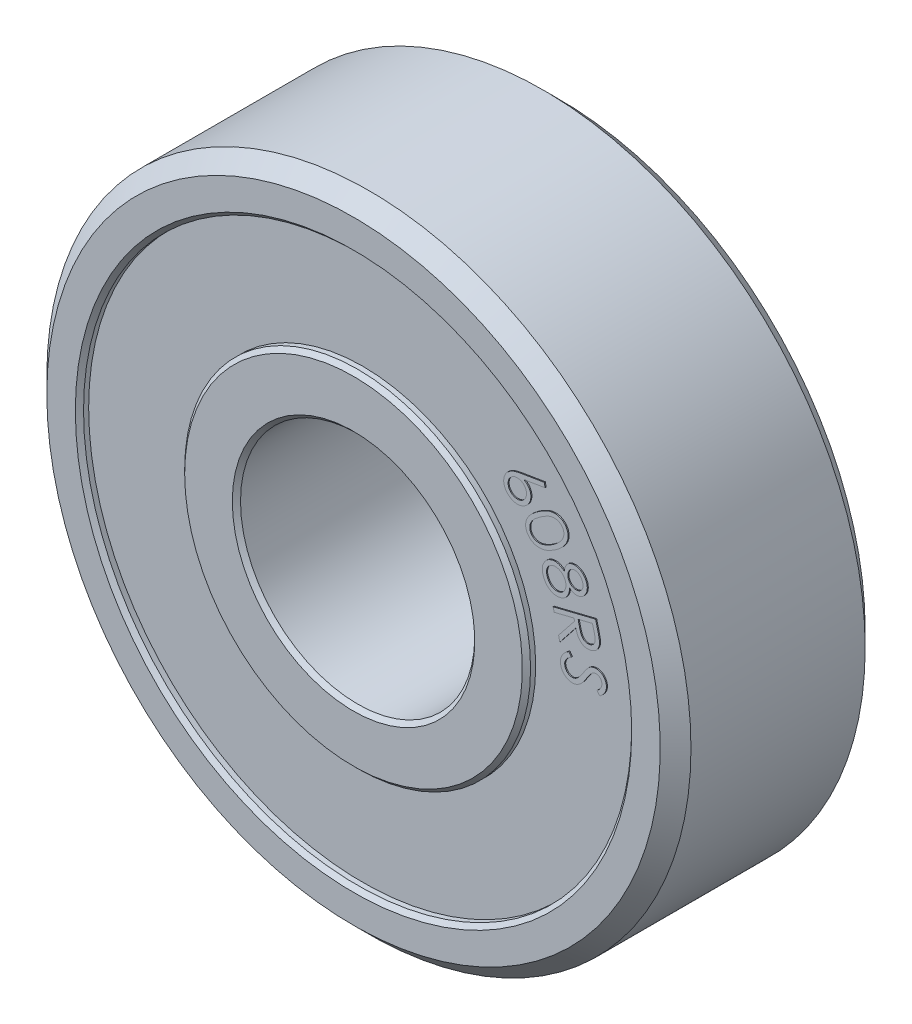
from build123d import *

# Parameters (mm, degrees)
CHAMFER1_SIZE       = 0.525
CHAMFER2_SIZE       = 0.14
BOSS_EXTRUDE1_DEPTH = 0.035
BOSS_EXTRUDE2_DEPTH = 0.035


with BuildPart() as part:
    # Sketch3 → Revolve1 (revolve)
    with BuildSketch(Plane(origin=(0, 0, 0), x_dir=(1, 0, 0), z_dir=(0, 1, 0)), mode=Mode.PRIVATE) as revolve1_sk:
        Polygon((-4, 3.5), (-4, -3.5), (-5.907, -3.5), (-5.907, -3.185), (-9.361, -3.185), (-9.361, -3.5), (-11, -3.5), (-11, 3.5), (-9.361, 3.5), (-9.361, 3.185), (-5.907, 3.185), (-5.907, 3.5), align=None)
    revolve(revolve1_sk.sketch.rotate(Axis((0, 0, 0), (0, 0, -1)), 180), axis=Axis((0, 0, 0), (0, 0, -1)))

    # Chamfer1
    chamfer1_edges = [part.edges().sort_by_distance(p)[0] for p in [
        (-11, 0, -3.5),
        (-11, 0, 3.5),
    ]]
    chamfer(chamfer1_edges, length=CHAMFER1_SIZE)

    # Chamfer2
    chamfer2_edges = [part.edges().sort_by_distance(p)[0] for p in [
        (-9.361, 0, -3.5),
        (-9.361, 0, 3.5),
        (-5.907, 0, 3.5),
        (-4, 0, 3.5),
        (-4, 0, -3.5),
        (-5.907, 0, -3.5),
    ]]
    chamfer(chamfer2_edges, length=CHAMFER2_SIZE)

    # Sketch4 → Boss-Extrude1 (add)
    # profile 1 of 5: a face of its own
    with BuildSketch(Plane.XY.offset(3.185)):
        with BuildLine():
            Line((7.07667654, 1.022925432), (7.160210194, 0.900629759))
            add(Edge.make_bspline(
                [(7.160210194, 0.900629759), (7.141447588, 0.888436917), (7.105531739, 0.865097075), (7.057551809, 0.826349804), (7.016778869, 0.78722919), (6.984335649, 0.746611843), (6.959030721, 0.705504508), (6.941948785, 0.663193638), (6.932294202, 0.619923397), (6.932595944, 0.59087902), (6.932746251, 0.576411009)],
                knots=[0, 0, 0, 0, 1.29047272, 2.470255192, 3.55337114, 4.544492507, 5.462378596, 6.328526614, 7.167381174, 8, 8, 8, 8], degree=3))
            add(Edge.make_bspline(
                [(6.932746251, 0.576411009), (6.933905167, 0.564034649), (6.936202821, 0.539497413), (6.945675097, 0.503880842), (6.95855727, 0.469486468), (6.975832035, 0.437054765), (6.996814934, 0.407544355), (7.020267717, 0.381197527), (7.046957613, 0.359509869), (7.075995877, 0.341934926), (7.10671197, 0.328861233), (7.138429535, 0.320053237), (7.170782004, 0.315219783), (7.192548403, 0.315868752), (7.203479425, 0.316194662)],
                knots=[0, 0, 0, 0, 1.069528151, 2.120434837, 3.164014076, 4.229739107, 5.276276838, 6.278412225, 7.259814643, 8.227918103, 9.1946739, 10.126585784, 11.059176948, 12, 12, 12, 12], degree=3))
            add(Edge.make_bspline(
                [(7.203479425, 0.316194662), (7.215889387, 0.317558695), (7.240990809, 0.320317702), (7.277573778, 0.332736849), (7.31374613, 0.35046738), (7.335732121, 0.366890755), (7.347109232, 0.375389374)],
                knots=[0, 0, 0, 0, 0.947396293, 1.916282626, 2.921736825, 4, 4, 4, 4], degree=3))
            add(Edge.make_bspline(
                [(7.347109232, 0.375389374), (7.355315739, 0.382296897), (7.372520778, 0.396778601), (7.397655571, 0.421720204), (7.424072389, 0.45001784), (7.451812103, 0.481770278), (7.479872253, 0.517774917), (7.509326683, 0.557143749), (7.540006026, 0.600042008), (7.56023173, 0.630241185), (7.570666925, 0.645822066)],
                knots=[0, 0, 0, 0, 0.730958445, 1.532463084, 2.411634773, 3.369963584, 4.405384716, 5.522415278, 6.721721622, 8, 8, 8, 8], degree=3))
            add(Edge.make_bspline(
                [(7.570666925, 0.645822066), (7.58100605, 0.66140006), (7.600811028, 0.691240283), (7.630288447, 0.732984052), (7.657048623, 0.77065839), (7.681884093, 0.803448734), (7.704333236, 0.832065554), (7.72514301, 0.855490556), (7.742950162, 0.875296859), (7.755069648, 0.885900722), (7.760570771, 0.890713893)],
                knots=[0, 0, 0, 0, 1.444476272, 2.766947634, 3.948124972, 5.014515193, 5.945117809, 6.756827866, 7.43571509, 8, 8, 8, 8], degree=3))
            add(Edge.make_bspline(
                [(7.760570771, 0.890713893), (7.768986681, 0.897553639), (7.785576497, 0.91103645), (7.811901455, 0.928823478), (7.838802268, 0.944162097), (7.866521006, 0.956813717), (7.894725739, 0.967589974), (7.923919221, 0.975055792), (7.95355704, 0.98122004), (7.973682054, 0.982777344), (7.983827982, 0.983562451)],
                knots=[0, 0, 0, 0, 1.057116076, 2.083834149, 3.094208353, 4.073123477, 5.052817915, 6.033680162, 7.008689374, 8, 8, 8, 8], degree=3))
            add(Edge.make_bspline(
                [(7.983827982, 0.983562451), (7.999771351, 0.984009415), (8.031186974, 0.984890137), (8.077543118, 0.978464867), (8.12222561, 0.966905793), (8.164522556, 0.948742094), (8.203936275, 0.925199961), (8.240218721, 0.896911761), (8.2717923, 0.862745609), (8.299386501, 0.824410083), (8.322050674, 0.782444042), (8.339742321, 0.738057912), (8.351345784, 0.691213204), (8.354515893, 0.659102581), (8.356123655, 0.642817259)],
                knots=[0, 0, 0, 0, 1.018652148, 2.007203782, 2.981557389, 3.963276115, 4.940048912, 5.911597161, 6.895153765, 7.905044761, 8.92560904, 9.938037021, 10.954248507, 12, 12, 12, 12], degree=3))
            add(Edge.make_bspline(
                [(8.356123655, 0.642817259), (8.356465849, 0.625473432), (8.35714514, 0.591044124), (8.350328978, 0.539754293), (8.33670078, 0.489863553), (8.319671763, 0.44960287), (8.302754538, 0.417592078), (8.286518086, 0.393389921), (8.268198136, 0.368324522), (8.247049249, 0.342725674), (8.223053734, 0.316670662), (8.196138901, 0.290367282), (8.167081318, 0.26306404), (8.146082883, 0.245573535), (8.13527029, 0.236567259)],
                knots=[0, 0, 0, 0, 1.293645858, 2.568022299, 3.846888115, 5.143965601, 5.823110895, 6.546932995, 7.317161764, 8.1405467, 9.024327785, 9.960223036, 10.949670444, 12, 12, 12, 12], degree=3))
            Line((8.13527029, 0.236567259), (8.035510675, 0.352552835))
            add(Edge.make_bspline(
                [(8.035510675, 0.352552835), (8.044069611, 0.359913519), (8.060582886, 0.374114934), (8.083721958, 0.395469727), (8.104527412, 0.415858208), (8.122874927, 0.435489421), (8.13919688, 0.453986559), (8.152944094, 0.471709896), (8.164695888, 0.488281052), (8.176470965, 0.509438873), (8.18825551, 0.535740893), (8.1976625, 0.568389201), (8.202259398, 0.602218966), (8.201872527, 0.624977664), (8.20167654, 0.636507162)],
                knots=[0, 0, 0, 0, 1.18491907, 2.286136418, 3.30469701, 4.241922326, 5.106378696, 5.892966819, 6.595836659, 7.236158252, 8.431804152, 9.613172754, 10.790839393, 12, 12, 12, 12], degree=3))
            add(Edge.make_bspline(
                [(8.20167654, 0.636507162), (8.200239344, 0.650939424), (8.19745814, 0.678868175), (8.184098523, 0.717894803), (8.164638125, 0.752467846), (8.138562121, 0.781523243), (8.108250475, 0.804938886), (8.074345918, 0.821419954), (8.037453125, 0.830108537), (8.012114844, 0.829849046), (7.999152501, 0.829716297)],
                knots=[0, 0, 0, 0, 1.109804571, 2.147650677, 3.139122909, 4.135498668, 5.122432153, 6.060918917, 7.008021436, 8, 8, 8, 8], degree=3))
            add(Edge.make_bspline(
                [(7.999152501, 0.829716297), (7.991109308, 0.829015906), (7.975068346, 0.82761908), (7.951453491, 0.821901829), (7.928295482, 0.814132745), (7.905314835, 0.80378723), (7.882365726, 0.789962944), (7.859114927, 0.771897045), (7.835119625, 0.749552674), (7.819545252, 0.732577), (7.811352021, 0.723646585)],
                knots=[0, 0, 0, 0, 0.871986768, 1.739048733, 2.619337774, 3.511278012, 4.458647955, 5.509359963, 6.68974577, 8, 8, 8, 8], degree=3))
            add(Edge.make_bspline(
                [(7.811352021, 0.723646585), (7.808606728, 0.720372987), (7.802036556, 0.71253845), (7.791799718, 0.697916646), (7.778383393, 0.679396196), (7.763010883, 0.656044654), (7.744237378, 0.628935367), (7.723250059, 0.597184237), (7.699454359, 0.561229248), (7.683011702, 0.535568485), (7.67433279, 0.522023989)],
                knots=[0, 0, 0, 0, 0.420303373, 1.005890829, 1.755318726, 2.671216084, 3.756658552, 5.000616378, 6.416838268, 8, 8, 8, 8], degree=3))
            add(Edge.make_bspline(
                [(7.67433279, 0.522023989), (7.663605132, 0.505737093), (7.642834125, 0.474202229), (7.61115255, 0.42932643), (7.58046771, 0.388114861), (7.549922707, 0.351148649), (7.520620356, 0.317722771), (7.492068008, 0.288105286), (7.464151255, 0.262403387), (7.428265333, 0.234075822), (7.383512292, 0.205105792), (7.328522202, 0.178883962), (7.272839446, 0.160778914), (7.234852526, 0.156800502), (7.216099617, 0.154836489)],
                knots=[0, 0, 0, 0, 1.151450178, 2.229450141, 3.243106685, 4.184340043, 5.060028281, 5.867215891, 6.612330199, 7.298581048, 8.565001162, 9.750115755, 10.88930515, 12, 12, 12, 12], degree=3))
            add(Edge.make_bspline(
                [(7.216099617, 0.154836489), (7.202770902, 0.154319434), (7.176360214, 0.153294894), (7.13722634, 0.157318139), (7.099057132, 0.164221028), (7.06225198, 0.176031416), (7.026215439, 0.190874269), (6.991695508, 0.210412281), (6.95799058, 0.233379906), (6.925975932, 0.260224207), (6.896128671, 0.289840671), (6.869910579, 0.322027302), (6.8468171, 0.3556143), (6.827880171, 0.391511679), (6.81207618, 0.429037525), (6.800490738, 0.468682129), (6.792140181, 0.510107393), (6.789738196, 0.538513553), (6.788515482, 0.552973509)],
                knots=[0, 0, 0, 0, 0.985497137, 1.952750817, 2.903057927, 3.849776994, 4.806101226, 5.781183158, 6.777868155, 7.819446761, 8.867225607, 9.883219966, 10.88602698, 11.877078448, 12.880131754, 13.892797948, 14.927343603, 16, 16, 16, 16], degree=3))
            add(Edge.make_bspline(
                [(6.788515482, 0.552973509), (6.788032527, 0.564191851), (6.787074922, 0.586435631), (6.788853843, 0.619552848), (6.792104272, 0.652069627), (6.7988837, 0.683755559), (6.806574026, 0.715078652), (6.817648017, 0.745392259), (6.830651439, 0.775120788), (6.84594597, 0.804347774), (6.864162329, 0.833058811), (6.885261393, 0.861466802), (6.909763912, 0.889200966), (6.93676161, 0.917093733), (6.967448939, 0.944080042), (7.0009151, 0.970974335), (7.037466393, 0.997629189), (7.063368672, 1.014339923), (7.07667654, 1.022925432)],
                knots=[0, 0, 0, 0, 0.925263907, 1.834617381, 2.732004908, 3.616301244, 4.503638723, 5.389129664, 6.272924556, 7.177955358, 8.10586898, 9.073750054, 10.092239338, 11.155095434, 12.272291164, 13.458848646, 14.694427327, 16, 16, 16, 16], degree=3))
        make_face()
    # profile 2 of 5: a face of its own
    with BuildSketch(Plane.XY.offset(3.185)):
        with BuildLine():
            Line((7.988249057, 2.436477879), (8.059763481, 2.14771586))
            add(Edge.make_bspline(
                [(8.059763481, 2.14771586), (8.064566506, 2.128407137), (8.073780818, 2.091364534), (8.085468727, 2.037955292), (8.096386616, 1.989498601), (8.104571978, 1.945536771), (8.111728491, 1.906438013), (8.11651398, 1.871946333), (8.119770695, 1.842285832), (8.120451336, 1.824004119), (8.120761077, 1.81568461)],
                knots=[0, 0, 0, 0, 1.412275468, 2.709364054, 3.880762931, 4.937697293, 5.883315439, 6.701766271, 7.409209202, 8, 8, 8, 8], degree=3))
            add(Edge.make_bspline(
                [(8.120761077, 1.81568461), (8.120776205, 1.804455954), (8.120805995, 1.782345383), (8.117122538, 1.749642538), (8.112002537, 1.717824468), (8.103880788, 1.687012638), (8.092733809, 1.657460157), (8.080091017, 1.62848464), (8.064205203, 1.600792231), (8.046264648, 1.57415575), (8.026330681, 1.548883112), (8.0038731, 1.525950847), (7.979450999, 1.505102958), (7.952912844, 1.486540832), (7.924590709, 1.469808257), (7.894006475, 1.455787629), (7.861485991, 1.443622059), (7.838767125, 1.437495917), (7.827191365, 1.434374514)],
                knots=[0, 0, 0, 0, 1.030695119, 2.029562332, 3.018848375, 3.989691521, 4.950321672, 5.918195338, 6.890563358, 7.878179212, 8.866823208, 9.842841206, 10.821890458, 11.812373873, 12.814456695, 13.839468472, 14.899161852, 16, 16, 16, 16], degree=3))
            add(Edge.make_bspline(
                [(7.827191365, 1.434374514), (7.807842429, 1.430242147), (7.770031648, 1.42216687), (7.713008492, 1.419161347), (7.657914739, 1.424442269), (7.60493808, 1.436817214), (7.554914707, 1.4574124), (7.50889861, 1.485783547), (7.466570201, 1.521074498), (7.435214739, 1.556388671), (7.412079066, 1.588533261), (7.395751148, 1.616043569), (7.379662863, 1.64611605), (7.364863908, 1.679274569), (7.35034608, 1.714990652), (7.336934555, 1.753663381), (7.323933649, 1.795004828), (7.316356122, 1.823763823), (7.312467807, 1.838521148)],
                knots=[0, 0, 0, 0, 1.275058133, 2.491658637, 3.66645437, 4.835727489, 5.988980319, 7.140493755, 8.310427396, 9.53238789, 10.176174421, 10.863292094, 11.594657208, 12.375481033, 13.204677601, 14.081459806, 15.015524659, 16, 16, 16, 16], degree=3))
            Line((7.312467807, 1.838521148), (6.767395692, 1.150119706))
            Line((6.767395692, 1.150119706), (6.722924538, 1.329506725))
            Line((6.722924538, 1.329506725), (7.268297134, 2.016706244))
            Line((7.268297134, 2.016706244), (7.247864442, 2.099638937))
            Line((7.247864442, 2.099638937), (6.573585596, 1.93287211))
            Line((6.573585596, 1.93287211), (6.537828384, 2.077703841))
            Line((6.537828384, 2.077703841), (7.988249057, 2.436477879))
        make_face()
        with BuildLine():
            Line((7.881878865, 2.256489898), (7.389090404, 2.134494706))
            Line((7.389090404, 2.134494706), (7.448886077, 1.884795187))
            add(Edge.make_bspline(
                [(7.448886077, 1.884795187), (7.45182527, 1.873158867), (7.457520768, 1.85061029), (7.466838888, 1.818246483), (7.476313313, 1.788288956), (7.486726516, 1.761214146), (7.496340237, 1.73629989), (7.507002503, 1.714323086), (7.517754957, 1.6947112), (7.532255082, 1.672175304), (7.552615295, 1.648055162), (7.579700381, 1.623195142), (7.610547944, 1.60386531), (7.643996391, 1.589418931), (7.679367087, 1.58013706), (7.715812573, 1.576210425), (7.752898708, 1.577633305), (7.777261552, 1.582662429), (7.789631269, 1.58521586)],
                knots=[0, 0, 0, 0, 1.113104627, 2.156947082, 3.123516869, 4.025994073, 4.847154809, 5.599249428, 6.289533952, 6.920849126, 8.081774125, 9.206640824, 10.317455789, 11.440940587, 12.574367923, 13.695699714, 14.830040429, 16, 16, 16, 16], degree=3))
            add(Edge.make_bspline(
                [(7.789631269, 1.58521586), (7.801466822, 1.588694436), (7.824748285, 1.595537069), (7.857407395, 1.61139247), (7.886733034, 1.632194925), (7.913064883, 1.656700921), (7.935729281, 1.684464794), (7.953040426, 1.715077862), (7.966255238, 1.747389364), (7.971981167, 1.776400765), (7.974560954, 1.801413296), (7.974215186, 1.822815659), (7.973109763, 1.846583651), (7.970321076, 1.872755814), (7.965921922, 1.901369873), (7.960758064, 1.932518189), (7.953232016, 1.965981516), (7.947804353, 1.989067449), (7.944979827, 2.001081244)],
                knots=[0, 0, 0, 0, 1.167139315, 2.295854676, 3.419774794, 4.560981809, 5.694511835, 6.79953169, 7.881294031, 8.986598963, 9.587027662, 10.260653181, 11.01114033, 11.840973709, 12.752038354, 13.753427265, 14.830895641, 16, 16, 16, 16], degree=3))
            Line((7.944979827, 2.001081244), (7.881878865, 2.256489898))
        make_face(mode=Mode.SUBTRACT)
    # profile 3 of 5: a face of its own
    with BuildSketch(Plane.XY.offset(3.185)):
        with BuildLine():
            add(Edge.make_bspline(
                [(7.099477061, 2.916616885), (7.098690101, 2.9028865), (7.09715369, 2.876080134), (7.092985297, 2.83695266), (7.087048148, 2.800021439), (7.079263716, 2.765282101), (7.069584789, 2.7328086), (7.058575742, 2.702299363), (7.045666126, 2.674082701), (7.026470991, 2.639601138), (6.997983189, 2.600609823), (6.95712362, 2.559819629), (6.909887318, 2.525090917), (6.874610565, 2.507556369), (6.856688599, 2.498648135)],
                knots=[0, 0, 0, 0, 0.965342537, 1.884675898, 2.760864322, 3.58985336, 4.381848198, 5.138145316, 5.864942154, 6.557429167, 7.906125783, 9.238559341, 10.597080462, 12, 12, 12, 12], degree=3))
            add(Edge.make_bspline(
                [(6.856688599, 2.498648135), (6.843551937, 2.493212735), (6.817555316, 2.482456423), (6.777425729, 2.470429715), (6.737070493, 2.462342737), (6.696455456, 2.457775315), (6.655516197, 2.456819168), (6.614272832, 2.459873851), (6.572746877, 2.46682108), (6.545437165, 2.474178583), (6.531568407, 2.477914962)],
                knots=[0, 0, 0, 0, 1.024409089, 2.027240591, 3.014246295, 3.987849499, 4.97008959, 5.961943143, 6.965008571, 8, 8, 8, 8], degree=3))
            add(Edge.make_bspline(
                [(6.531568407, 2.477914962), (6.514970093, 2.483396231), (6.481931859, 2.494306462), (6.435476623, 2.518287713), (6.391897929, 2.547266594), (6.351424448, 2.581734444), (6.314297534, 2.621796628), (6.28034537, 2.667197599), (6.249029569, 2.717846665), (6.231820134, 2.754664197), (6.222974657, 2.773588039)],
                knots=[0, 0, 0, 0, 0.948770785, 1.888487593, 2.830597946, 3.78830618, 4.770470995, 5.792787649, 6.865514951, 8, 8, 8, 8], degree=3))
            add(Edge.make_bspline(
                [(6.222974657, 2.773588039), (6.215133096, 2.792093014), (6.199883465, 2.828079991), (6.183093716, 2.882637116), (6.171771998, 2.935534446), (6.165963934, 2.986767995), (6.165474195, 3.036456556), (6.170889796, 3.084596486), (6.182069342, 3.131096775), (6.198693822, 3.175514014), (6.219566763, 3.21705369), (6.242243036, 3.256202215), (6.267927341, 3.291722853), (6.295928171, 3.324062706), (6.326521651, 3.353149592), (6.359511414, 3.378914565), (6.39494262, 3.401593741), (6.420247826, 3.413577557), (6.433010715, 3.419621693)],
                knots=[0, 0, 0, 0, 1.267552484, 2.465033387, 3.595541775, 4.676687165, 5.713239991, 6.724590993, 7.72561979, 8.723531106, 9.710008357, 10.656307103, 11.575452967, 12.471469328, 13.352174575, 14.234669623, 15.10964117, 16, 16, 16, 16], degree=3))
            add(Edge.make_bspline(
                [(6.433010715, 3.419621693), (6.451945373, 3.427252095), (6.489317417, 3.442312506), (6.548174368, 3.453923085), (6.607377257, 3.457622684), (6.656897206, 3.452397024), (6.696656061, 3.443700399), (6.727305438, 3.434244986), (6.758398949, 3.421896741), (6.790004068, 3.406810697), (6.82207532, 3.38887992), (6.854651029, 3.368185307), (6.887902143, 3.344682121), (6.909563792, 3.327292446), (6.920691003, 3.318359674)],
                knots=[0, 0, 0, 0, 1.388903063, 2.741329987, 4.068022215, 5.419983727, 6.119076723, 6.840420774, 7.603683985, 8.397719782, 9.226007249, 10.106800958, 11.027496746, 12, 12, 12, 12], degree=3))
            add(Edge.make_bspline(
                [(6.920691003, 3.318359674), (6.922416007, 3.33815898), (6.925766449, 3.376614797), (6.938516463, 3.4314329), (6.956876387, 3.481537798), (6.981233493, 3.52645573), (7.010927679, 3.566017352), (7.044681546, 3.600353575), (7.08303308, 3.62888672), (7.111357193, 3.642989462), (7.125618888, 3.650090443)],
                knots=[0, 0, 0, 0, 1.159455953, 2.251989289, 3.275466029, 4.267453533, 5.224383785, 6.154995403, 7.071007414, 8, 8, 8, 8], degree=3))
            add(Edge.make_bspline(
                [(7.125618888, 3.650090443), (7.140784671, 3.656125705), (7.171244213, 3.668247156), (7.220406735, 3.676978247), (7.271611777, 3.679937549), (7.324483051, 3.674978996), (7.3777268, 3.664436859), (7.429164329, 3.645351706), (7.478344254, 3.619639342), (7.524407009, 3.586754876), (7.566876847, 3.548215734), (7.604595304, 3.504590832), (7.637684844, 3.456624288), (7.654614554, 3.421476721), (7.663178984, 3.403696212)],
                knots=[0, 0, 0, 0, 0.895244176, 1.79804272, 2.729926455, 3.708035493, 4.709107929, 5.705490053, 6.712842463, 7.751725752, 8.808089461, 9.858062073, 10.916432989, 12, 12, 12, 12], degree=3))
            add(Edge.make_bspline(
                [(7.663178984, 3.403696212), (7.67035787, 3.385923855), (7.684569717, 3.3507404), (7.697539371, 3.295598726), (7.704149556, 3.23981489), (7.702960004, 3.183903133), (7.695841876, 3.128995992), (7.681048534, 3.076585322), (7.66048745, 3.026813363), (7.632647526, 2.981127198), (7.60006994, 2.939720628), (7.563296396, 2.903616553), (7.522291258, 2.873560451), (7.492246281, 2.858608937), (7.477181388, 2.851112078)],
                knots=[0, 0, 0, 0, 1.065698776, 2.109735047, 3.142348307, 4.185162942, 5.215017637, 6.216077376, 7.208152383, 8.203606168, 9.184144294, 10.13441058, 11.064572233, 12, 12, 12, 12], degree=3))
            add(Edge.make_bspline(
                [(7.477181388, 2.851112078), (7.461811162, 2.844928996), (7.431691896, 2.83281272), (7.38438854, 2.822942252), (7.337001481, 2.820164504), (7.28931966, 2.824658231), (7.24170868, 2.837178473), (7.193793237, 2.85628733), (7.145835064, 2.88303581), (7.115281565, 2.905168328), (7.099477061, 2.916616885)],
                knots=[0, 0, 0, 0, 0.981441566, 1.923218336, 2.851834376, 3.789100335, 4.751923234, 5.762773344, 6.842742724, 8, 8, 8, 8], degree=3))
        make_face()
        with BuildLine():
            add(Edge.make_bspline(
                [(7.527361676, 3.351112078), (7.523097312, 3.360199134), (7.514730134, 3.378028994), (7.499935055, 3.403129186), (7.483436395, 3.42588213), (7.465477472, 3.446629313), (7.446074409, 3.465299839), (7.424730163, 3.481514749), (7.402303138, 3.496155872), (7.378223223, 3.507847978), (7.353875998, 3.518016743), (7.329175294, 3.524685397), (7.304891148, 3.529471251), (7.280693151, 3.531226469), (7.256687592, 3.530413443), (7.232979838, 3.526561116), (7.209340204, 3.520841666), (7.194256217, 3.514486892), (7.186616484, 3.511268328)],
                knots=[0, 0, 0, 0, 1.149478509, 2.255410412, 3.331842264, 4.364834456, 5.395529974, 6.409938299, 7.431653227, 8.457932417, 9.472146045, 10.449336842, 11.383265003, 12.30377508, 13.222352288, 14.127865584, 15.051801889, 16, 16, 16, 16], degree=3))
            add(Edge.make_bspline(
                [(7.186616484, 3.511268328), (7.179210433, 3.507735119), (7.164425471, 3.50068165), (7.143950632, 3.487010849), (7.1252368, 3.471021654), (7.108371709, 3.452672371), (7.092550911, 3.432586041), (7.078820131, 3.409915267), (7.066748213, 3.385033074), (7.056488127, 3.358380661), (7.047903084, 3.330747591), (7.042697778, 3.302696323), (7.039514419, 3.274977281), (7.039228351, 3.247492421), (7.041655199, 3.220216975), (7.046796978, 3.193152142), (7.054605803, 3.166159534), (7.061846408, 3.148725836), (7.065522734, 3.139874097)],
                knots=[0, 0, 0, 0, 0.913588282, 1.8238287, 2.734342874, 3.650519037, 4.597263948, 5.579410922, 6.597870941, 7.675830255, 8.760013937, 9.817432142, 10.850470097, 11.86635747, 12.874981817, 13.897410551, 14.932436916, 16, 16, 16, 16], degree=3))
            add(Edge.make_bspline(
                [(7.065522734, 3.139874097), (7.070959428, 3.128901918), (7.081768454, 3.107087451), (7.102848741, 3.077091089), (7.127685788, 3.04995061), (7.155739729, 3.025718054), (7.186547721, 3.00520753), (7.219528305, 2.989641615), (7.253886432, 2.978173503), (7.28944269, 2.972123437), (7.324857297, 2.970300964), (7.358971872, 2.972633143), (7.391426739, 2.979084875), (7.411569456, 2.986931277), (7.421592445, 2.990835635)],
                knots=[0, 0, 0, 0, 1.031641173, 2.051069438, 3.079627614, 4.127876024, 5.170526819, 6.190759836, 7.195237181, 8.216064607, 9.222635688, 10.179631979, 11.094187263, 12, 12, 12, 12], degree=3))
            add(Edge.make_bspline(
                [(7.421592445, 2.990835635), (7.428380542, 2.994097834), (7.441834788, 3.000563626), (7.460546499, 3.012728333), (7.477875735, 3.026807362), (7.49409738, 3.042521431), (7.508581439, 3.060693781), (7.522125872, 3.080376547), (7.534114181, 3.102145621), (7.544636096, 3.125494726), (7.553186319, 3.150357098), (7.558540573, 3.176516559), (7.560814701, 3.203518774), (7.560768441, 3.231458067), (7.556490763, 3.260192337), (7.549846266, 3.289941925), (7.540305784, 3.320549956), (7.531744883, 3.34076296), (7.527361676, 3.351112078)],
                knots=[0, 0, 0, 0, 0.861246098, 1.707020142, 2.546635082, 3.413962428, 4.285822876, 5.201494312, 6.145638261, 7.125634198, 8.12973634, 9.148131545, 10.17244471, 11.227095727, 12.337580052, 13.488904777, 14.714311927, 16, 16, 16, 16], degree=3))
        make_face(mode=Mode.SUBTRACT)
        with BuildLine():
            add(Edge.make_bspline(
                [(6.94292658, 3.083083232), (6.937511898, 3.094501989), (6.926876659, 3.116930122), (6.90782408, 3.148374001), (6.886403756, 3.176970791), (6.862909194, 3.203098765), (6.836819033, 3.22618916), (6.80890987, 3.247203372), (6.778321104, 3.264842557), (6.746103968, 3.279740199), (6.713008536, 3.291649256), (6.679965342, 3.300524421), (6.647222536, 3.305649077), (6.614914719, 3.3074758), (6.582856292, 3.306078157), (6.551258492, 3.300825895), (6.519992592, 3.292480401), (6.499941505, 3.284323565), (6.48980158, 3.280198616)],
                knots=[0, 0, 0, 0, 1.104879646, 2.170147449, 3.209190263, 4.226359185, 5.237663233, 6.2521877, 7.276949504, 8.319605622, 9.353279052, 10.34990469, 11.307730634, 12.246618305, 13.176305, 14.108176917, 15.043296571, 16, 16, 16, 16], degree=3))
            add(Edge.make_bspline(
                [(6.48980158, 3.280198616), (6.477590225, 3.274122016), (6.453291607, 3.262030565), (6.420229197, 3.237920997), (6.39091662, 3.2089056), (6.364962501, 3.176098276), (6.342991615, 3.139884681), (6.327645934, 3.100319251), (6.316700957, 3.058825409), (6.312491848, 3.015066163), (6.313713689, 2.969852137), (6.320805705, 2.923453879), (6.333706986, 2.876146119), (6.346523276, 2.845276803), (6.35308283, 2.829477462)],
                knots=[0, 0, 0, 0, 0.93106017, 1.852658975, 2.782157342, 3.74228721, 4.706217079, 5.664759167, 6.63278887, 7.630760756, 8.658030412, 9.717242117, 10.83165311, 12, 12, 12, 12], degree=3))
            add(Edge.make_bspline(
                [(6.35308283, 2.829477462), (6.358795012, 2.817453822), (6.36996505, 2.793941877), (6.389698931, 2.761163904), (6.410755892, 2.731116218), (6.434656667, 2.705049173), (6.459456093, 2.681070209), (6.48703858, 2.661202905), (6.516007429, 2.643688222), (6.546890941, 2.630075422), (6.578480104, 2.619758442), (6.610010868, 2.612118947), (6.641188429, 2.607359609), (6.672209769, 2.606789263), (6.702963233, 2.608222337), (6.733323042, 2.613908492), (6.763436609, 2.622282027), (6.782838546, 2.630164257), (6.792686195, 2.634164962)],
                knots=[0, 0, 0, 0, 1.187799049, 2.32271294, 3.412182945, 4.457103108, 5.475669338, 6.486234943, 7.484659388, 8.493442864, 9.4917071, 10.448242522, 11.387907995, 12.300458686, 13.214191694, 14.131636859, 15.051693354, 16, 16, 16, 16], degree=3))
            add(Edge.make_bspline(
                [(6.792686195, 2.634164962), (6.802000329, 2.638686177), (6.820442159, 2.647638105), (6.846169844, 2.664235729), (6.869377632, 2.683788641), (6.890946846, 2.705428359), (6.910093061, 2.729949874), (6.92746202, 2.75677957), (6.941946466, 2.786507788), (6.954918909, 2.818032635), (6.964923617, 2.850930745), (6.97213196, 2.884280158), (6.97520046, 2.917644711), (6.97566745, 2.950936975), (6.972568999, 2.984151001), (6.966288698, 3.017397922), (6.956255015, 3.050532813), (6.947410681, 3.072132257), (6.94292658, 3.083083232)],
                knots=[0, 0, 0, 0, 0.947755998, 1.876541055, 2.795075564, 3.722727265, 4.669772601, 5.639344173, 6.644502255, 7.693900057, 8.758900776, 9.789851169, 10.813140356, 11.822309394, 12.8355981, 13.862950336, 14.916510208, 16, 16, 16, 16], degree=3))
        make_face(mode=Mode.SUBTRACT)
    # profile 4 of 5: a face of its own
    with BuildSketch(Plane.XY.offset(3.185)):
        with BuildLine():
            add(Edge.make_bspline(
                [(6.037227467, 4.642718036), (6.057094583, 4.65613681), (6.095614375, 4.682154092), (6.152751343, 4.718427659), (6.207816061, 4.750349101), (6.260598909, 4.778190592), (6.310831122, 4.802592763), (6.358965658, 4.82235161), (6.404608365, 4.838549737), (6.448354611, 4.850378577), (6.490378263, 4.858646919), (6.530947718, 4.864946034), (6.570529075, 4.867893458), (6.609072912, 4.868208615), (6.64657926, 4.866009948), (6.682877262, 4.860330083), (6.718231495, 4.852721294), (6.752354098, 4.841850953), (6.785033437, 4.82846092), (6.816597741, 4.813717778), (6.845855382, 4.795728937), (6.873874409, 4.776210575), (6.899831525, 4.754100166), (6.924842873, 4.730399797), (6.947524689, 4.703932569), (6.961234714, 4.684982846), (6.96811689, 4.67547044)],
                knots=[0, 0, 0, 0, 1.647129504, 3.193572886, 4.648909682, 6.018759553, 7.29304213, 8.484092823, 9.591856658, 10.618504854, 11.59425893, 12.533412202, 13.437522283, 14.318391754, 15.18034948, 16.015377867, 16.84016362, 17.662851007, 18.471751712, 19.265851772, 20.053033852, 20.828212915, 21.609749875, 22.393314094, 23.193473807, 24, 24, 24, 24], degree=3))
            add(Edge.make_bspline(
                [(6.96811689, 4.67547044), (6.974691556, 4.665453307), (6.987686636, 4.645654062), (7.004185167, 4.614410257), (7.018376865, 4.582633979), (7.029882495, 4.54998687), (7.038608235, 4.516517226), (7.044629107, 4.482245295), (7.047819087, 4.447176158), (7.048877306, 4.411426109), (7.046722512, 4.37514075), (7.041563598, 4.338572565), (7.033389964, 4.301814149), (7.022200259, 4.264771162), (7.008047159, 4.227524772), (6.990855075, 4.190035745), (6.970189695, 4.152632006), (6.947202396, 4.114508749), (6.920103599, 4.076430176), (6.889227459, 4.037987861), (6.853825938, 3.99952811), (6.814392241, 3.96074376), (6.770732894, 3.921813818), (6.723141694, 3.882275537), (6.671181665, 3.842763862), (6.634664289, 3.816984579), (6.615953428, 3.803775728)],
                knots=[0, 0, 0, 0, 0.817406176, 1.615634439, 2.408310713, 3.190989697, 3.975279195, 4.766509705, 5.563067635, 6.37683521, 7.205399771, 8.040705308, 8.894903476, 9.772977452, 10.679516765, 11.612477996, 12.585263849, 13.594734046, 14.649306836, 15.772465298, 16.957971508, 18.214830785, 19.546137893, 20.949227517, 22.436837916, 24, 24, 24, 24], degree=3))
            add(Edge.make_bspline(
                [(6.615953428, 3.803775728), (6.596994477, 3.791046538), (6.56010598, 3.766279309), (6.504969401, 3.731867957), (6.451597766, 3.701205213), (6.399852157, 3.674240006), (6.349689362, 3.651557777), (6.301512092, 3.631969846), (6.254886029, 3.616683474), (6.209927892, 3.604845118), (6.166455623, 3.596367746), (6.124290629, 3.590971205), (6.083446829, 3.588199615), (6.043692409, 3.588178112), (6.005123379, 3.590809741), (5.967662905, 3.596254056), (5.931426937, 3.604265615), (5.896633795, 3.615489345), (5.863236835, 3.62905024), (5.831366907, 3.64464127), (5.801107765, 3.662356673), (5.772842713, 3.682694831), (5.746014805, 3.704867364), (5.721058788, 3.729338339), (5.697639818, 3.755809848), (5.683895193, 3.775099679), (5.676951024, 3.78484544)],
                knots=[0, 0, 0, 0, 1.560028747, 3.035353374, 4.439169797, 5.764352503, 7.019863392, 8.19904352, 9.315608849, 10.369526857, 11.373338683, 12.339210382, 13.271860963, 14.168262247, 15.053123715, 15.910518822, 16.752178043, 17.585338262, 18.404928143, 19.212837357, 20.007334297, 20.797220964, 21.589238784, 22.382821712, 23.182956368, 24, 24, 24, 24], degree=3))
            add(Edge.make_bspline(
                [(5.676951024, 3.78484544), (5.670488857, 3.794668923), (5.65764504, 3.814193494), (5.641219675, 3.844866568), (5.627200085, 3.876253894), (5.616275019, 3.908412199), (5.607276897, 3.941166108), (5.60138479, 3.974767622), (5.598049143, 4.00912649), (5.597502397, 4.044087766), (5.599523808, 4.079467761), (5.604679988, 4.115047058), (5.612925988, 4.150788749), (5.624037921, 4.186613076), (5.637908109, 4.222741496), (5.655176688, 4.258641229), (5.675116767, 4.294864455), (5.697979723, 4.331504742), (5.724986308, 4.368272711), (5.756142071, 4.405742432), (5.791945251, 4.443782737), (5.832311274, 4.482415776), (5.876882397, 4.521976218), (5.926235601, 4.561673643), (5.979855624, 4.602483319), (6.017702415, 4.62902517), (6.037227467, 4.642718036)],
                knots=[0, 0, 0, 0, 0.808545094, 1.607016031, 2.390572183, 3.170667031, 3.94117853, 4.72509814, 5.514239008, 6.313631024, 7.128114177, 7.949562325, 8.78362858, 9.648874088, 10.52794611, 11.443317486, 12.386959759, 13.371499477, 14.412023987, 15.522728756, 16.72191576, 18.003527559, 19.365383565, 20.820278601, 22.359590797, 24, 24, 24, 24], degree=3))
        make_face()
        with BuildLine():
            add(Edge.make_bspline(
                [(6.114751505, 4.525230055), (6.097945797, 4.513520707), (6.06540956, 4.49085114), (6.019477823, 4.456162661), (5.977364475, 4.422841962), (5.938950433, 4.390735727), (5.904803599, 4.359301532), (5.874661349, 4.328887079), (5.848278004, 4.299766803), (5.819229339, 4.262807933), (5.789470409, 4.217189184), (5.76281132, 4.161344394), (5.74553765, 4.105360884), (5.738363763, 4.049785219), (5.739847756, 3.99637044), (5.748918869, 3.946025901), (5.765114048, 3.898945089), (5.782285002, 3.871115659), (5.790833236, 3.857261305)],
                knots=[0, 0, 0, 0, 1.185152516, 2.294482493, 3.329998515, 4.292496795, 5.190781738, 6.01454992, 6.769749679, 7.463125579, 8.73316175, 9.912802692, 11.033085895, 12.10855937, 13.140631027, 14.112627847, 15.060407543, 16, 16, 16, 16], degree=3))
            add(Edge.make_bspline(
                [(5.790833236, 3.857261305), (5.800810289, 3.844238224), (5.820703092, 3.818272079), (5.858689013, 3.78629279), (5.901725286, 3.75981414), (5.941893774, 3.743482882), (5.976364163, 3.733905775), (6.003621239, 3.728947962), (6.031835058, 3.725659833), (6.060984803, 3.725775599), (6.091121667, 3.727010435), (6.122197555, 3.731210362), (6.154284255, 3.736970222), (6.175686919, 3.742812944), (6.186566409, 3.74578294)],
                knots=[0, 0, 0, 0, 1.338254874, 2.668287098, 4.032388645, 5.45768343, 6.196937663, 6.955233525, 7.721407655, 8.515997641, 9.33614231, 10.186530784, 11.078169926, 12, 12, 12, 12], degree=3))
            add(Edge.make_bspline(
                [(6.186566409, 3.74578294), (6.200238365, 3.749734106), (6.228128358, 3.757794254), (6.269737279, 3.773056222), (6.312381287, 3.790391957), (6.355287829, 3.810980025), (6.399269647, 3.833490231), (6.443495952, 3.859166223), (6.488780644, 3.887086994), (6.518670623, 3.907329215), (6.533922178, 3.91765794)],
                knots=[0, 0, 0, 0, 0.876980802, 1.788989781, 2.730286543, 3.713474192, 4.721357833, 5.775076266, 6.864718289, 8, 8, 8, 8], degree=3))
            add(Edge.make_bspline(
                [(6.533922178, 3.91765794), (6.548893406, 3.928208167), (6.578192511, 3.94885525), (6.620312812, 3.980222618), (6.65916665, 4.011964373), (6.695085474, 4.043292975), (6.728067815, 4.074460108), (6.758223503, 4.10519323), (6.784930377, 4.136329391), (6.809041671, 4.166971842), (6.830518862, 4.197235697), (6.848824055, 4.227497456), (6.864893773, 4.25718327), (6.878149051, 4.286615321), (6.888617104, 4.315585244), (6.897113352, 4.343984976), (6.90200077, 4.372239304), (6.905665283, 4.408640232), (6.904527241, 4.452597386), (6.896033578, 4.502739784), (6.879546749, 4.549429512), (6.862464669, 4.576977774), (6.853934197, 4.590734863)],
                knots=[0, 0, 0, 0, 1.325707742, 2.594446445, 3.800335424, 4.956353489, 6.043602115, 7.084390889, 8.071287936, 9.011098833, 9.906164952, 10.755398265, 11.569524375, 12.348344283, 13.089151471, 13.798201088, 14.490750199, 15.160928209, 16.444494422, 17.659069597, 18.830983035, 20, 20, 20, 20], degree=3))
            add(Edge.make_bspline(
                [(6.853934197, 4.590734863), (6.843983644, 4.603883604), (6.824144215, 4.630099583), (6.78568996, 4.662056971), (6.742067395, 4.688624335), (6.701162174, 4.704586908), (6.666442848, 4.714728973), (6.638940881, 4.719705174), (6.610619508, 4.722736006), (6.581393606, 4.723572577), (6.551255665, 4.7224395), (6.520257649, 4.718679881), (6.488360092, 4.712938834), (6.455308405, 4.705082479), (6.420595358, 4.694480117), (6.383984741, 4.680122722), (6.344896534, 4.662642999), (6.303443877, 4.641796623), (6.259486021, 4.617744041), (6.213322414, 4.589959025), (6.164601947, 4.559038977), (6.131719638, 4.536737962), (6.114751505, 4.525230055)],
                knots=[0, 0, 0, 0, 1.189220811, 2.371070278, 3.589933538, 4.870677491, 5.533443445, 6.204121069, 6.888970323, 7.592047094, 8.317101447, 9.068357924, 9.848540479, 10.66037283, 11.524322563, 12.471502636, 13.502804957, 14.620587954, 15.826702855, 17.126322975, 18.517107438, 20, 20, 20, 20], degree=3))
        make_face(mode=Mode.SUBTRACT)
    # profile 5 of 5: a face of its own
    with BuildSketch(Plane.XY.offset(3.185)):
        with BuildLine():
            Line((6.236662201, 5.607100457), (6.262203066, 5.462268726))
            Line((6.262203066, 5.462268726), (5.539246335, 5.337569207))
            add(Edge.make_bspline(
                [(5.539246335, 5.337569207), (5.55136475, 5.330722079), (5.574975399, 5.317381628), (5.607963871, 5.295064035), (5.637525297, 5.271107498), (5.655070403, 5.253585034), (5.663645374, 5.24502113)],
                knots=[0, 0, 0, 0, 1.072545372, 2.089670422, 3.066348163, 4, 4, 4, 4], degree=3))
            add(Edge.make_bspline(
                [(5.663645374, 5.24502113), (5.673270521, 5.234073052), (5.69220373, 5.212537562), (5.716700009, 5.177629325), (5.737248353, 5.141383564), (5.753297504, 5.103318771), (5.765305026, 5.063834113), (5.773504628, 5.022782212), (5.777365096, 4.980182793), (5.776943553, 4.936626525), (5.772815487, 4.893079983), (5.764851673, 4.850535699), (5.752268721, 4.809648942), (5.736115945, 4.770244069), (5.715827152, 4.732346328), (5.691252111, 4.696286999), (5.663007722, 4.661374796), (5.641331552, 4.640147147), (5.630292009, 4.629336034)],
                knots=[0, 0, 0, 0, 1.017957941, 2.002381035, 2.973756876, 3.923951531, 4.882536872, 5.852903753, 6.84387255, 7.865672398, 8.892135131, 9.896847588, 10.884251381, 11.87588719, 12.868436323, 13.881668073, 14.92114628, 16, 16, 16, 16], degree=3))
            add(Edge.make_bspline(
                [(5.630292009, 4.629336034), (5.614416152, 4.615363845), (5.583273581, 4.587955566), (5.531117296, 4.555036253), (5.476389953, 4.529561241), (5.419203703, 4.511716277), (5.360343388, 4.502116449), (5.300667304, 4.500476991), (5.240562675, 4.507725601), (5.180841449, 4.522603123), (5.123114313, 4.54537919), (5.068930212, 4.57518569), (5.018319402, 4.611087577), (4.989075484, 4.640406565), (4.974342489, 4.65517738)],
                knots=[0, 0, 0, 0, 1.038543283, 2.037238647, 3.019959535, 3.999763744, 4.972961005, 5.943475403, 6.925159144, 7.940449789, 8.961992099, 9.967018228, 10.975790086, 12, 12, 12, 12], degree=3))
            add(Edge.make_bspline(
                [(4.974342489, 4.65517738), (4.960992103, 4.670368163), (4.934546725, 4.700459129), (4.902666985, 4.751174746), (4.877839926, 4.805280379), (4.859772444, 4.862152294), (4.849458762, 4.920879332), (4.847733233, 4.980245793), (4.853966639, 5.039552261), (4.869063611, 5.097965981), (4.89055342, 5.154629274), (4.919896211, 5.207304915), (4.954645152, 5.256673268), (4.983109639, 5.285071651), (4.997479509, 5.299408149)],
                knots=[0, 0, 0, 0, 1.012573728, 2.005776911, 2.989837351, 3.990312212, 4.989172915, 5.968777985, 6.95857368, 7.968155016, 8.985498265, 9.987748213, 10.98414482, 12, 12, 12, 12], degree=3))
            add(Edge.make_bspline(
                [(4.997479509, 5.299408149), (5.009100581, 5.309672922), (5.032705741, 5.330523113), (5.072614702, 5.357744802), (5.11617344, 5.382763232), (5.1557363, 5.400976972), (5.189719551, 5.414996857), (5.217865255, 5.424720538), (5.248227796, 5.434148299), (5.280748765, 5.44295736), (5.315449086, 5.451839021), (5.352347973, 5.459853746), (5.391447554, 5.4673194), (5.418245052, 5.471927173), (5.431974701, 5.474287957)],
                knots=[0, 0, 0, 0, 1.173294982, 2.38324085, 3.650604812, 4.974070361, 5.678388931, 6.434099636, 7.228273161, 8.085849389, 8.985503613, 9.940748063, 10.944946012, 12, 12, 12, 12], degree=3))
            Line((5.431974701, 5.474287957), (6.236662201, 5.607100457))
        make_face()
        with BuildLine():
            add(Edge.make_bspline(
                [(5.543753547, 5.181319207), (5.536285807, 5.188886898), (5.5215066, 5.203863915), (5.497084221, 5.223349706), (5.471376605, 5.239986007), (5.444502674, 5.253862389), (5.416388544, 5.265154013), (5.386842251, 5.273227915), (5.356016985, 5.2782772), (5.32445115, 5.280569177), (5.292744163, 5.280524326), (5.261677841, 5.276713777), (5.231687027, 5.270500367), (5.202678242, 5.261497879), (5.175051335, 5.248933394), (5.148176858, 5.233958426), (5.122437712, 5.215879197), (5.106715054, 5.201720663), (5.098741528, 5.194540361)],
                knots=[0, 0, 0, 0, 1.029721301, 2.037894256, 3.020697922, 3.993236409, 4.964853954, 5.951628753, 6.95544592, 7.987361231, 9.016395945, 10.023025455, 11.014943709, 11.982040835, 12.959797671, 13.950765448, 14.960759433, 16, 16, 16, 16], degree=3))
            add(Edge.make_bspline(
                [(5.098741528, 5.194540361), (5.09116058, 5.187081053), (5.076157328, 5.172318533), (5.056881322, 5.147796657), (5.039578658, 5.122601328), (5.026231825, 5.09541036), (5.01491262, 5.067272081), (5.006928956, 5.037593945), (5.001383056, 5.006840506), (4.999190333, 4.975229732), (4.999339508, 4.943554857), (5.002632254, 4.912542745), (5.008969345, 4.882531654), (5.018357666, 4.85368403), (5.030368219, 4.825820249), (5.045524169, 4.79925615), (5.063668671, 4.773878909), (5.07756531, 4.75812542), (5.084618932, 4.750129303)],
                knots=[0, 0, 0, 0, 1.031107461, 2.040637569, 3.021975928, 3.991398874, 4.973362887, 5.961466034, 6.968278189, 8.001582615, 9.032002564, 10.038908564, 11.022651107, 12.003267062, 12.978423701, 13.962262289, 14.965690192, 16, 16, 16, 16], degree=3))
            add(Edge.make_bspline(
                [(5.084618932, 4.750129303), (5.092086683, 4.742561659), (5.106865913, 4.727584735), (5.131288126, 4.708098263), (5.156996352, 4.691464467), (5.18386804, 4.677578869), (5.211900792, 4.666357652), (5.241316718, 4.658163209), (5.272056085, 4.653217545), (5.303626921, 4.650733763), (5.335300118, 4.651451411), (5.366324775, 4.654563688), (5.396265825, 4.661059082), (5.425234538, 4.669955658), (5.45302996, 4.682084096), (5.479605013, 4.697204875), (5.504979288, 4.715358898), (5.520733185, 4.72925423), (5.528729509, 4.736307188)],
                knots=[0, 0, 0, 0, 1.03211654, 2.04263461, 3.02772438, 4.002525093, 4.976402722, 5.956095755, 6.962247905, 7.99656356, 9.028129589, 10.036020983, 11.020726252, 11.999355715, 12.975466677, 13.960268085, 14.964677979, 16, 16, 16, 16], degree=3))
            add(Edge.make_bspline(
                [(5.528729509, 4.736307188), (5.536408926, 4.743866752), (5.551508145, 4.758730316), (5.571003028, 4.783377758), (5.588140195, 4.808939629), (5.601766631, 4.836114374), (5.613210183, 4.86425837), (5.621135862, 4.893856853), (5.626690439, 4.924607209), (5.628883179, 4.956219603), (5.628725032, 4.987891191), (5.625467089, 5.018914482), (5.619009547, 5.04885552), (5.610102974, 5.077824237), (5.597977206, 5.105619658), (5.582855704, 5.132194711), (5.564701877, 5.157568987), (5.550806518, 5.173322883), (5.543753547, 5.181319207)],
                knots=[0, 0, 0, 0, 1.043357436, 2.051442412, 3.039467042, 4.020553715, 4.992086471, 5.978775158, 6.984146072, 8.015971333, 9.044916246, 10.05038087, 11.032715196, 12.008988344, 12.982749056, 13.96517929, 14.967170796, 16, 16, 16, 16], degree=3))
        make_face(mode=Mode.SUBTRACT)
    extrude(amount=BOSS_EXTRUDE1_DEPTH)

    # Sketch5 → Boss-Extrude2 (add)
    # profile 1 of 5: a face of its own
    with BuildSketch(Plane(origin=(0, 0, -3.185), x_dir=(-1, 0, 0), z_dir=(0, 0, -1))):
        with BuildLine():
            Line((7.07667654, 1.022925432), (7.160210194, 0.900629759))
            add(Edge.make_bspline(
                [(7.160210194, 0.900629759), (7.141447588, 0.888436917), (7.105531739, 0.865097075), (7.057551809, 0.826349804), (7.016778869, 0.78722919), (6.984335649, 0.746611843), (6.959030721, 0.705504508), (6.941948785, 0.663193638), (6.932294202, 0.619923397), (6.932595944, 0.59087902), (6.932746251, 0.576411009)],
                knots=[0, 0, 0, 0, 1.29047272, 2.470255192, 3.55337114, 4.544492507, 5.462378596, 6.328526614, 7.167381174, 8, 8, 8, 8], degree=3))
            add(Edge.make_bspline(
                [(6.932746251, 0.576411009), (6.933905167, 0.564034649), (6.936202821, 0.539497413), (6.945675097, 0.503880842), (6.95855727, 0.469486468), (6.975832035, 0.437054765), (6.996814934, 0.407544355), (7.020267717, 0.381197527), (7.046957613, 0.359509869), (7.075995877, 0.341934926), (7.10671197, 0.328861233), (7.138429535, 0.320053237), (7.170782004, 0.315219783), (7.192548403, 0.315868752), (7.203479425, 0.316194662)],
                knots=[0, 0, 0, 0, 1.069528151, 2.120434837, 3.164014076, 4.229739107, 5.276276838, 6.278412225, 7.259814643, 8.227918103, 9.1946739, 10.126585784, 11.059176948, 12, 12, 12, 12], degree=3))
            add(Edge.make_bspline(
                [(7.203479425, 0.316194662), (7.215889387, 0.317558695), (7.240990809, 0.320317702), (7.277573778, 0.332736849), (7.31374613, 0.35046738), (7.335732121, 0.366890755), (7.347109232, 0.375389374)],
                knots=[0, 0, 0, 0, 0.947396293, 1.916282626, 2.921736825, 4, 4, 4, 4], degree=3))
            add(Edge.make_bspline(
                [(7.347109232, 0.375389374), (7.355315739, 0.382296897), (7.372520778, 0.396778601), (7.397655571, 0.421720204), (7.424072389, 0.45001784), (7.451812103, 0.481770278), (7.479872253, 0.517774917), (7.509326683, 0.557143749), (7.540006026, 0.600042008), (7.56023173, 0.630241185), (7.570666925, 0.645822066)],
                knots=[0, 0, 0, 0, 0.730958445, 1.532463084, 2.411634773, 3.369963584, 4.405384716, 5.522415278, 6.721721622, 8, 8, 8, 8], degree=3))
            add(Edge.make_bspline(
                [(7.570666925, 0.645822066), (7.58100605, 0.66140006), (7.600811028, 0.691240283), (7.630288447, 0.732984052), (7.657048623, 0.77065839), (7.681884093, 0.803448734), (7.704333236, 0.832065554), (7.72514301, 0.855490556), (7.742950162, 0.875296859), (7.755069648, 0.885900722), (7.760570771, 0.890713893)],
                knots=[0, 0, 0, 0, 1.444476272, 2.766947634, 3.948124972, 5.014515193, 5.945117809, 6.756827866, 7.43571509, 8, 8, 8, 8], degree=3))
            add(Edge.make_bspline(
                [(7.760570771, 0.890713893), (7.768986681, 0.897553639), (7.785576497, 0.91103645), (7.811901455, 0.928823478), (7.838802268, 0.944162097), (7.866521006, 0.956813717), (7.894725739, 0.967589974), (7.923919221, 0.975055792), (7.95355704, 0.98122004), (7.973682054, 0.982777344), (7.983827982, 0.983562451)],
                knots=[0, 0, 0, 0, 1.057116076, 2.083834149, 3.094208353, 4.073123477, 5.052817915, 6.033680162, 7.008689374, 8, 8, 8, 8], degree=3))
            add(Edge.make_bspline(
                [(7.983827982, 0.983562451), (7.999771351, 0.984009415), (8.031186974, 0.984890137), (8.077543118, 0.978464867), (8.12222561, 0.966905793), (8.164522556, 0.948742094), (8.203936275, 0.925199961), (8.240218721, 0.896911761), (8.2717923, 0.862745609), (8.299386501, 0.824410083), (8.322050674, 0.782444042), (8.339742321, 0.738057912), (8.351345784, 0.691213204), (8.354515893, 0.659102581), (8.356123655, 0.642817259)],
                knots=[0, 0, 0, 0, 1.018652148, 2.007203782, 2.981557389, 3.963276115, 4.940048912, 5.911597161, 6.895153765, 7.905044761, 8.92560904, 9.938037021, 10.954248507, 12, 12, 12, 12], degree=3))
            add(Edge.make_bspline(
                [(8.356123655, 0.642817259), (8.356465849, 0.625473432), (8.35714514, 0.591044124), (8.350328978, 0.539754293), (8.33670078, 0.489863553), (8.319671763, 0.44960287), (8.302754538, 0.417592078), (8.286518086, 0.393389921), (8.268198136, 0.368324522), (8.247049249, 0.342725674), (8.223053734, 0.316670662), (8.196138901, 0.290367282), (8.167081318, 0.26306404), (8.146082883, 0.245573535), (8.13527029, 0.236567259)],
                knots=[0, 0, 0, 0, 1.293645858, 2.568022299, 3.846888115, 5.143965601, 5.823110895, 6.546932995, 7.317161764, 8.1405467, 9.024327785, 9.960223036, 10.949670444, 12, 12, 12, 12], degree=3))
            Line((8.13527029, 0.236567259), (8.035510675, 0.352552835))
            add(Edge.make_bspline(
                [(8.035510675, 0.352552835), (8.044069611, 0.359913519), (8.060582886, 0.374114934), (8.083721958, 0.395469727), (8.104527412, 0.415858208), (8.122874927, 0.435489421), (8.13919688, 0.453986559), (8.152944094, 0.471709896), (8.164695888, 0.488281052), (8.176470965, 0.509438873), (8.18825551, 0.535740893), (8.1976625, 0.568389201), (8.202259398, 0.602218966), (8.201872527, 0.624977664), (8.20167654, 0.636507162)],
                knots=[0, 0, 0, 0, 1.18491907, 2.286136418, 3.30469701, 4.241922326, 5.106378696, 5.892966819, 6.595836659, 7.236158252, 8.431804152, 9.613172754, 10.790839393, 12, 12, 12, 12], degree=3))
            add(Edge.make_bspline(
                [(8.20167654, 0.636507162), (8.200239344, 0.650939424), (8.19745814, 0.678868175), (8.184098523, 0.717894803), (8.164638125, 0.752467846), (8.138562121, 0.781523243), (8.108250475, 0.804938886), (8.074345918, 0.821419954), (8.037453125, 0.830108537), (8.012114844, 0.829849046), (7.999152501, 0.829716297)],
                knots=[0, 0, 0, 0, 1.109804571, 2.147650677, 3.139122909, 4.135498668, 5.122432153, 6.060918917, 7.008021436, 8, 8, 8, 8], degree=3))
            add(Edge.make_bspline(
                [(7.999152501, 0.829716297), (7.991109308, 0.829015906), (7.975068346, 0.82761908), (7.951453491, 0.821901829), (7.928295482, 0.814132745), (7.905314835, 0.80378723), (7.882365726, 0.789962944), (7.859114927, 0.771897045), (7.835119625, 0.749552674), (7.819545252, 0.732577), (7.811352021, 0.723646585)],
                knots=[0, 0, 0, 0, 0.871986768, 1.739048733, 2.619337774, 3.511278012, 4.458647955, 5.509359963, 6.68974577, 8, 8, 8, 8], degree=3))
            add(Edge.make_bspline(
                [(7.811352021, 0.723646585), (7.808606728, 0.720372987), (7.802036556, 0.71253845), (7.791799718, 0.697916646), (7.778383393, 0.679396196), (7.763010883, 0.656044654), (7.744237378, 0.628935367), (7.723250059, 0.597184237), (7.699454359, 0.561229248), (7.683011702, 0.535568485), (7.67433279, 0.522023989)],
                knots=[0, 0, 0, 0, 0.420303373, 1.005890829, 1.755318726, 2.671216084, 3.756658552, 5.000616378, 6.416838268, 8, 8, 8, 8], degree=3))
            add(Edge.make_bspline(
                [(7.67433279, 0.522023989), (7.663605132, 0.505737093), (7.642834125, 0.474202229), (7.61115255, 0.42932643), (7.58046771, 0.388114861), (7.549922707, 0.351148649), (7.520620356, 0.317722771), (7.492068008, 0.288105286), (7.464151255, 0.262403387), (7.428265333, 0.234075822), (7.383512292, 0.205105792), (7.328522202, 0.178883962), (7.272839446, 0.160778914), (7.234852526, 0.156800502), (7.216099617, 0.154836489)],
                knots=[0, 0, 0, 0, 1.151450178, 2.229450141, 3.243106685, 4.184340043, 5.060028281, 5.867215891, 6.612330199, 7.298581048, 8.565001162, 9.750115755, 10.88930515, 12, 12, 12, 12], degree=3))
            add(Edge.make_bspline(
                [(7.216099617, 0.154836489), (7.202770902, 0.154319434), (7.176360214, 0.153294894), (7.13722634, 0.157318139), (7.099057132, 0.164221028), (7.06225198, 0.176031416), (7.026215439, 0.190874269), (6.991695508, 0.210412281), (6.95799058, 0.233379906), (6.925975932, 0.260224207), (6.896128671, 0.289840671), (6.869910579, 0.322027302), (6.8468171, 0.3556143), (6.827880171, 0.391511679), (6.81207618, 0.429037525), (6.800490738, 0.468682129), (6.792140181, 0.510107393), (6.789738196, 0.538513553), (6.788515482, 0.552973509)],
                knots=[0, 0, 0, 0, 0.985497137, 1.952750817, 2.903057927, 3.849776994, 4.806101226, 5.781183158, 6.777868155, 7.819446761, 8.867225607, 9.883219966, 10.88602698, 11.877078448, 12.880131754, 13.892797948, 14.927343603, 16, 16, 16, 16], degree=3))
            add(Edge.make_bspline(
                [(6.788515482, 0.552973509), (6.788032527, 0.564191851), (6.787074922, 0.586435631), (6.788853843, 0.619552848), (6.792104272, 0.652069627), (6.7988837, 0.683755559), (6.806574026, 0.715078652), (6.817648017, 0.745392259), (6.830651439, 0.775120788), (6.84594597, 0.804347774), (6.864162329, 0.833058811), (6.885261393, 0.861466802), (6.909763912, 0.889200966), (6.93676161, 0.917093733), (6.967448939, 0.944080042), (7.0009151, 0.970974335), (7.037466393, 0.997629189), (7.063368672, 1.014339923), (7.07667654, 1.022925432)],
                knots=[0, 0, 0, 0, 0.925263907, 1.834617381, 2.732004908, 3.616301244, 4.503638723, 5.389129664, 6.272924556, 7.177955358, 8.10586898, 9.073750054, 10.092239338, 11.155095434, 12.272291164, 13.458848646, 14.694427327, 16, 16, 16, 16], degree=3))
        make_face()
    # profile 2 of 5: a face of its own
    with BuildSketch(Plane(origin=(0, 0, -3.185), x_dir=(-1, 0, 0), z_dir=(0, 0, -1))):
        with BuildLine():
            Line((7.988249057, 2.436477879), (8.059763481, 2.14771586))
            add(Edge.make_bspline(
                [(8.059763481, 2.14771586), (8.064566506, 2.128407137), (8.073780818, 2.091364534), (8.085468727, 2.037955292), (8.096386616, 1.989498601), (8.104571978, 1.945536771), (8.111728491, 1.906438013), (8.11651398, 1.871946333), (8.119770695, 1.842285832), (8.120451336, 1.824004119), (8.120761077, 1.81568461)],
                knots=[0, 0, 0, 0, 1.412275468, 2.709364054, 3.880762931, 4.937697293, 5.883315439, 6.701766271, 7.409209202, 8, 8, 8, 8], degree=3))
            add(Edge.make_bspline(
                [(8.120761077, 1.81568461), (8.120776205, 1.804455954), (8.120805995, 1.782345383), (8.117122538, 1.749642538), (8.112002537, 1.717824468), (8.103880788, 1.687012638), (8.092733809, 1.657460157), (8.080091017, 1.62848464), (8.064205203, 1.600792231), (8.046264648, 1.57415575), (8.026330681, 1.548883112), (8.0038731, 1.525950847), (7.979450999, 1.505102958), (7.952912844, 1.486540832), (7.924590709, 1.469808257), (7.894006475, 1.455787629), (7.861485991, 1.443622059), (7.838767125, 1.437495917), (7.827191365, 1.434374514)],
                knots=[0, 0, 0, 0, 1.030695119, 2.029562332, 3.018848375, 3.989691521, 4.950321672, 5.918195338, 6.890563358, 7.878179212, 8.866823208, 9.842841206, 10.821890458, 11.812373873, 12.814456695, 13.839468472, 14.899161852, 16, 16, 16, 16], degree=3))
            add(Edge.make_bspline(
                [(7.827191365, 1.434374514), (7.807842429, 1.430242147), (7.770031648, 1.42216687), (7.713008492, 1.419161347), (7.657914739, 1.424442269), (7.60493808, 1.436817214), (7.554914707, 1.4574124), (7.50889861, 1.485783547), (7.466570201, 1.521074498), (7.435214739, 1.556388671), (7.412079066, 1.588533261), (7.395751148, 1.616043569), (7.379662863, 1.64611605), (7.364863908, 1.679274569), (7.35034608, 1.714990652), (7.336934555, 1.753663381), (7.323933649, 1.795004828), (7.316356122, 1.823763823), (7.312467807, 1.838521148)],
                knots=[0, 0, 0, 0, 1.275058133, 2.491658637, 3.66645437, 4.835727489, 5.988980319, 7.140493755, 8.310427396, 9.53238789, 10.176174421, 10.863292094, 11.594657208, 12.375481033, 13.204677601, 14.081459806, 15.015524659, 16, 16, 16, 16], degree=3))
            Line((7.312467807, 1.838521148), (6.767395692, 1.150119706))
            Line((6.767395692, 1.150119706), (6.722924538, 1.329506725))
            Line((6.722924538, 1.329506725), (7.268297134, 2.016706244))
            Line((7.268297134, 2.016706244), (7.247864442, 2.099638937))
            Line((7.247864442, 2.099638937), (6.573585596, 1.93287211))
            Line((6.573585596, 1.93287211), (6.537828384, 2.077703841))
            Line((6.537828384, 2.077703841), (7.988249057, 2.436477879))
        make_face()
        with BuildLine():
            Line((7.881878865, 2.256489898), (7.389090404, 2.134494706))
            Line((7.389090404, 2.134494706), (7.448886077, 1.884795187))
            add(Edge.make_bspline(
                [(7.448886077, 1.884795187), (7.45182527, 1.873158867), (7.457520768, 1.85061029), (7.466838888, 1.818246483), (7.476313313, 1.788288956), (7.486726516, 1.761214146), (7.496340237, 1.73629989), (7.507002503, 1.714323086), (7.517754957, 1.6947112), (7.532255082, 1.672175304), (7.552615295, 1.648055162), (7.579700381, 1.623195142), (7.610547944, 1.60386531), (7.643996391, 1.589418931), (7.679367087, 1.58013706), (7.715812573, 1.576210425), (7.752898708, 1.577633305), (7.777261552, 1.582662429), (7.789631269, 1.58521586)],
                knots=[0, 0, 0, 0, 1.113104627, 2.156947082, 3.123516869, 4.025994073, 4.847154809, 5.599249428, 6.289533952, 6.920849126, 8.081774125, 9.206640824, 10.317455789, 11.440940587, 12.574367923, 13.695699714, 14.830040429, 16, 16, 16, 16], degree=3))
            add(Edge.make_bspline(
                [(7.789631269, 1.58521586), (7.801466822, 1.588694436), (7.824748285, 1.595537069), (7.857407395, 1.61139247), (7.886733034, 1.632194925), (7.913064883, 1.656700921), (7.935729281, 1.684464794), (7.953040426, 1.715077862), (7.966255238, 1.747389364), (7.971981167, 1.776400765), (7.974560954, 1.801413296), (7.974215186, 1.822815659), (7.973109763, 1.846583651), (7.970321076, 1.872755814), (7.965921922, 1.901369873), (7.960758064, 1.932518189), (7.953232016, 1.965981516), (7.947804353, 1.989067449), (7.944979827, 2.001081244)],
                knots=[0, 0, 0, 0, 1.167139315, 2.295854676, 3.419774794, 4.560981809, 5.694511835, 6.79953169, 7.881294031, 8.986598963, 9.587027662, 10.260653181, 11.01114033, 11.840973709, 12.752038354, 13.753427265, 14.830895641, 16, 16, 16, 16], degree=3))
            Line((7.944979827, 2.001081244), (7.881878865, 2.256489898))
        make_face(mode=Mode.SUBTRACT)
    # profile 3 of 5: a face of its own
    with BuildSketch(Plane(origin=(0, 0, -3.185), x_dir=(-1, 0, 0), z_dir=(0, 0, -1))):
        with BuildLine():
            add(Edge.make_bspline(
                [(7.099477061, 2.916616885), (7.098690101, 2.9028865), (7.09715369, 2.876080134), (7.092985297, 2.83695266), (7.087048148, 2.800021439), (7.079263716, 2.765282101), (7.069584789, 2.7328086), (7.058575742, 2.702299363), (7.045666126, 2.674082701), (7.026470991, 2.639601138), (6.997983189, 2.600609823), (6.95712362, 2.559819629), (6.909887318, 2.525090917), (6.874610565, 2.507556369), (6.856688599, 2.498648135)],
                knots=[0, 0, 0, 0, 0.965342537, 1.884675898, 2.760864322, 3.58985336, 4.381848198, 5.138145316, 5.864942154, 6.557429167, 7.906125783, 9.238559341, 10.597080462, 12, 12, 12, 12], degree=3))
            add(Edge.make_bspline(
                [(6.856688599, 2.498648135), (6.843551937, 2.493212735), (6.817555316, 2.482456423), (6.777425729, 2.470429715), (6.737070493, 2.462342737), (6.696455456, 2.457775315), (6.655516197, 2.456819168), (6.614272832, 2.459873851), (6.572746877, 2.46682108), (6.545437165, 2.474178583), (6.531568407, 2.477914962)],
                knots=[0, 0, 0, 0, 1.024409089, 2.027240591, 3.014246295, 3.987849499, 4.97008959, 5.961943143, 6.965008571, 8, 8, 8, 8], degree=3))
            add(Edge.make_bspline(
                [(6.531568407, 2.477914962), (6.514970093, 2.483396231), (6.481931859, 2.494306462), (6.435476623, 2.518287713), (6.391897929, 2.547266594), (6.351424448, 2.581734444), (6.314297534, 2.621796628), (6.28034537, 2.667197599), (6.249029569, 2.717846665), (6.231820134, 2.754664197), (6.222974657, 2.773588039)],
                knots=[0, 0, 0, 0, 0.948770785, 1.888487593, 2.830597946, 3.78830618, 4.770470995, 5.792787649, 6.865514951, 8, 8, 8, 8], degree=3))
            add(Edge.make_bspline(
                [(6.222974657, 2.773588039), (6.215133096, 2.792093014), (6.199883465, 2.828079991), (6.183093716, 2.882637116), (6.171771998, 2.935534446), (6.165963934, 2.986767995), (6.165474195, 3.036456556), (6.170889796, 3.084596486), (6.182069342, 3.131096775), (6.198693822, 3.175514014), (6.219566763, 3.21705369), (6.242243036, 3.256202215), (6.267927341, 3.291722853), (6.295928171, 3.324062706), (6.326521651, 3.353149592), (6.359511414, 3.378914565), (6.39494262, 3.401593741), (6.420247826, 3.413577557), (6.433010715, 3.419621693)],
                knots=[0, 0, 0, 0, 1.267552484, 2.465033387, 3.595541775, 4.676687165, 5.713239991, 6.724590993, 7.72561979, 8.723531106, 9.710008357, 10.656307103, 11.575452967, 12.471469328, 13.352174575, 14.234669623, 15.10964117, 16, 16, 16, 16], degree=3))
            add(Edge.make_bspline(
                [(6.433010715, 3.419621693), (6.451945373, 3.427252095), (6.489317417, 3.442312506), (6.548174368, 3.453923085), (6.607377257, 3.457622684), (6.656897206, 3.452397024), (6.696656061, 3.443700399), (6.727305438, 3.434244986), (6.758398949, 3.421896741), (6.790004068, 3.406810697), (6.82207532, 3.38887992), (6.854651029, 3.368185307), (6.887902143, 3.344682121), (6.909563792, 3.327292446), (6.920691003, 3.318359674)],
                knots=[0, 0, 0, 0, 1.388903063, 2.741329987, 4.068022215, 5.419983727, 6.119076723, 6.840420774, 7.603683985, 8.397719782, 9.226007249, 10.106800958, 11.027496746, 12, 12, 12, 12], degree=3))
            add(Edge.make_bspline(
                [(6.920691003, 3.318359674), (6.922416007, 3.33815898), (6.925766449, 3.376614797), (6.938516463, 3.4314329), (6.956876387, 3.481537798), (6.981233493, 3.52645573), (7.010927679, 3.566017352), (7.044681546, 3.600353575), (7.08303308, 3.62888672), (7.111357193, 3.642989462), (7.125618888, 3.650090443)],
                knots=[0, 0, 0, 0, 1.159455953, 2.251989289, 3.275466029, 4.267453533, 5.224383785, 6.154995403, 7.071007414, 8, 8, 8, 8], degree=3))
            add(Edge.make_bspline(
                [(7.125618888, 3.650090443), (7.140784671, 3.656125705), (7.171244213, 3.668247156), (7.220406735, 3.676978247), (7.271611777, 3.679937549), (7.324483051, 3.674978996), (7.3777268, 3.664436859), (7.429164329, 3.645351706), (7.478344254, 3.619639342), (7.524407009, 3.586754876), (7.566876847, 3.548215734), (7.604595304, 3.504590832), (7.637684844, 3.456624288), (7.654614554, 3.421476721), (7.663178984, 3.403696212)],
                knots=[0, 0, 0, 0, 0.895244176, 1.79804272, 2.729926455, 3.708035493, 4.709107929, 5.705490053, 6.712842463, 7.751725752, 8.808089461, 9.858062073, 10.916432989, 12, 12, 12, 12], degree=3))
            add(Edge.make_bspline(
                [(7.663178984, 3.403696212), (7.67035787, 3.385923855), (7.684569717, 3.3507404), (7.697539371, 3.295598726), (7.704149556, 3.23981489), (7.702960004, 3.183903133), (7.695841876, 3.128995992), (7.681048534, 3.076585322), (7.66048745, 3.026813363), (7.632647526, 2.981127198), (7.60006994, 2.939720628), (7.563296396, 2.903616553), (7.522291258, 2.873560451), (7.492246281, 2.858608937), (7.477181388, 2.851112078)],
                knots=[0, 0, 0, 0, 1.065698776, 2.109735047, 3.142348307, 4.185162942, 5.215017637, 6.216077376, 7.208152383, 8.203606168, 9.184144294, 10.13441058, 11.064572233, 12, 12, 12, 12], degree=3))
            add(Edge.make_bspline(
                [(7.477181388, 2.851112078), (7.461811162, 2.844928996), (7.431691896, 2.83281272), (7.38438854, 2.822942252), (7.337001481, 2.820164504), (7.28931966, 2.824658231), (7.24170868, 2.837178473), (7.193793237, 2.85628733), (7.145835064, 2.88303581), (7.115281565, 2.905168328), (7.099477061, 2.916616885)],
                knots=[0, 0, 0, 0, 0.981441566, 1.923218336, 2.851834376, 3.789100335, 4.751923234, 5.762773344, 6.842742724, 8, 8, 8, 8], degree=3))
        make_face()
        with BuildLine():
            add(Edge.make_bspline(
                [(7.527361676, 3.351112078), (7.523097312, 3.360199134), (7.514730134, 3.378028994), (7.499935055, 3.403129186), (7.483436395, 3.42588213), (7.465477472, 3.446629313), (7.446074409, 3.465299839), (7.424730163, 3.481514749), (7.402303138, 3.496155872), (7.378223223, 3.507847978), (7.353875998, 3.518016743), (7.329175294, 3.524685397), (7.304891148, 3.529471251), (7.280693151, 3.531226469), (7.256687592, 3.530413443), (7.232979838, 3.526561116), (7.209340204, 3.520841666), (7.194256217, 3.514486892), (7.186616484, 3.511268328)],
                knots=[0, 0, 0, 0, 1.149478509, 2.255410412, 3.331842264, 4.364834456, 5.395529974, 6.409938299, 7.431653227, 8.457932417, 9.472146045, 10.449336842, 11.383265003, 12.30377508, 13.222352288, 14.127865584, 15.051801889, 16, 16, 16, 16], degree=3))
            add(Edge.make_bspline(
                [(7.186616484, 3.511268328), (7.179210433, 3.507735119), (7.164425471, 3.50068165), (7.143950632, 3.487010849), (7.1252368, 3.471021654), (7.108371709, 3.452672371), (7.092550911, 3.432586041), (7.078820131, 3.409915267), (7.066748213, 3.385033074), (7.056488127, 3.358380661), (7.047903084, 3.330747591), (7.042697778, 3.302696323), (7.039514419, 3.274977281), (7.039228351, 3.247492421), (7.041655199, 3.220216975), (7.046796978, 3.193152142), (7.054605803, 3.166159534), (7.061846408, 3.148725836), (7.065522734, 3.139874097)],
                knots=[0, 0, 0, 0, 0.913588282, 1.8238287, 2.734342874, 3.650519037, 4.597263948, 5.579410922, 6.597870941, 7.675830255, 8.760013937, 9.817432142, 10.850470097, 11.86635747, 12.874981817, 13.897410551, 14.932436916, 16, 16, 16, 16], degree=3))
            add(Edge.make_bspline(
                [(7.065522734, 3.139874097), (7.070959428, 3.128901918), (7.081768454, 3.107087451), (7.102848741, 3.077091089), (7.127685788, 3.04995061), (7.155739729, 3.025718054), (7.186547721, 3.00520753), (7.219528305, 2.989641615), (7.253886432, 2.978173503), (7.28944269, 2.972123437), (7.324857297, 2.970300964), (7.358971872, 2.972633143), (7.391426739, 2.979084875), (7.411569456, 2.986931277), (7.421592445, 2.990835635)],
                knots=[0, 0, 0, 0, 1.031641173, 2.051069438, 3.079627614, 4.127876024, 5.170526819, 6.190759836, 7.195237181, 8.216064607, 9.222635688, 10.179631979, 11.094187263, 12, 12, 12, 12], degree=3))
            add(Edge.make_bspline(
                [(7.421592445, 2.990835635), (7.428380542, 2.994097834), (7.441834788, 3.000563626), (7.460546499, 3.012728333), (7.477875735, 3.026807362), (7.49409738, 3.042521431), (7.508581439, 3.060693781), (7.522125872, 3.080376547), (7.534114181, 3.102145621), (7.544636096, 3.125494726), (7.553186319, 3.150357098), (7.558540573, 3.176516559), (7.560814701, 3.203518774), (7.560768441, 3.231458067), (7.556490763, 3.260192337), (7.549846266, 3.289941925), (7.540305784, 3.320549956), (7.531744883, 3.34076296), (7.527361676, 3.351112078)],
                knots=[0, 0, 0, 0, 0.861246098, 1.707020142, 2.546635082, 3.413962428, 4.285822876, 5.201494312, 6.145638261, 7.125634198, 8.12973634, 9.148131545, 10.17244471, 11.227095727, 12.337580052, 13.488904777, 14.714311927, 16, 16, 16, 16], degree=3))
        make_face(mode=Mode.SUBTRACT)
        with BuildLine():
            add(Edge.make_bspline(
                [(6.94292658, 3.083083232), (6.937511898, 3.094501989), (6.926876659, 3.116930122), (6.90782408, 3.148374001), (6.886403756, 3.176970791), (6.862909194, 3.203098765), (6.836819033, 3.22618916), (6.80890987, 3.247203372), (6.778321104, 3.264842557), (6.746103968, 3.279740199), (6.713008536, 3.291649256), (6.679965342, 3.300524421), (6.647222536, 3.305649077), (6.614914719, 3.3074758), (6.582856292, 3.306078157), (6.551258492, 3.300825895), (6.519992592, 3.292480401), (6.499941505, 3.284323565), (6.48980158, 3.280198616)],
                knots=[0, 0, 0, 0, 1.104879646, 2.170147449, 3.209190263, 4.226359185, 5.237663233, 6.2521877, 7.276949504, 8.319605622, 9.353279052, 10.34990469, 11.307730634, 12.246618305, 13.176305, 14.108176917, 15.043296571, 16, 16, 16, 16], degree=3))
            add(Edge.make_bspline(
                [(6.48980158, 3.280198616), (6.477590225, 3.274122016), (6.453291607, 3.262030565), (6.420229197, 3.237920997), (6.39091662, 3.2089056), (6.364962501, 3.176098276), (6.342991615, 3.139884681), (6.327645934, 3.100319251), (6.316700957, 3.058825409), (6.312491848, 3.015066163), (6.313713689, 2.969852137), (6.320805705, 2.923453879), (6.333706986, 2.876146119), (6.346523276, 2.845276803), (6.35308283, 2.829477462)],
                knots=[0, 0, 0, 0, 0.93106017, 1.852658975, 2.782157342, 3.74228721, 4.706217079, 5.664759167, 6.63278887, 7.630760756, 8.658030412, 9.717242117, 10.83165311, 12, 12, 12, 12], degree=3))
            add(Edge.make_bspline(
                [(6.35308283, 2.829477462), (6.358795012, 2.817453822), (6.36996505, 2.793941877), (6.389698931, 2.761163904), (6.410755892, 2.731116218), (6.434656667, 2.705049173), (6.459456093, 2.681070209), (6.48703858, 2.661202905), (6.516007429, 2.643688222), (6.546890941, 2.630075422), (6.578480104, 2.619758442), (6.610010868, 2.612118947), (6.641188429, 2.607359609), (6.672209769, 2.606789263), (6.702963233, 2.608222337), (6.733323042, 2.613908492), (6.763436609, 2.622282027), (6.782838546, 2.630164257), (6.792686195, 2.634164962)],
                knots=[0, 0, 0, 0, 1.187799049, 2.32271294, 3.412182945, 4.457103108, 5.475669338, 6.486234943, 7.484659388, 8.493442864, 9.4917071, 10.448242522, 11.387907995, 12.300458686, 13.214191694, 14.131636859, 15.051693354, 16, 16, 16, 16], degree=3))
            add(Edge.make_bspline(
                [(6.792686195, 2.634164962), (6.802000329, 2.638686177), (6.820442159, 2.647638105), (6.846169844, 2.664235729), (6.869377632, 2.683788641), (6.890946846, 2.705428359), (6.910093061, 2.729949874), (6.92746202, 2.75677957), (6.941946466, 2.786507788), (6.954918909, 2.818032635), (6.964923617, 2.850930745), (6.97213196, 2.884280158), (6.97520046, 2.917644711), (6.97566745, 2.950936975), (6.972568999, 2.984151001), (6.966288698, 3.017397922), (6.956255015, 3.050532813), (6.947410681, 3.072132257), (6.94292658, 3.083083232)],
                knots=[0, 0, 0, 0, 0.947755998, 1.876541055, 2.795075564, 3.722727265, 4.669772601, 5.639344173, 6.644502255, 7.693900057, 8.758900776, 9.789851169, 10.813140356, 11.822309394, 12.8355981, 13.862950336, 14.916510208, 16, 16, 16, 16], degree=3))
        make_face(mode=Mode.SUBTRACT)
    # profile 4 of 5: a face of its own
    with BuildSketch(Plane(origin=(0, 0, -3.185), x_dir=(-1, 0, 0), z_dir=(0, 0, -1))):
        with BuildLine():
            add(Edge.make_bspline(
                [(6.037227467, 4.642718036), (6.057094583, 4.65613681), (6.095614375, 4.682154092), (6.152751343, 4.718427659), (6.207816061, 4.750349101), (6.260598909, 4.778190592), (6.310831122, 4.802592763), (6.358965658, 4.82235161), (6.404608365, 4.838549737), (6.448354611, 4.850378577), (6.490378263, 4.858646919), (6.530947718, 4.864946034), (6.570529075, 4.867893458), (6.609072912, 4.868208615), (6.64657926, 4.866009948), (6.682877262, 4.860330083), (6.718231495, 4.852721294), (6.752354098, 4.841850953), (6.785033437, 4.82846092), (6.816597741, 4.813717778), (6.845855382, 4.795728937), (6.873874409, 4.776210575), (6.899831525, 4.754100166), (6.924842873, 4.730399797), (6.947524689, 4.703932569), (6.961234714, 4.684982846), (6.96811689, 4.67547044)],
                knots=[0, 0, 0, 0, 1.647129504, 3.193572886, 4.648909682, 6.018759553, 7.29304213, 8.484092823, 9.591856658, 10.618504854, 11.59425893, 12.533412202, 13.437522283, 14.318391754, 15.18034948, 16.015377867, 16.84016362, 17.662851007, 18.471751712, 19.265851772, 20.053033852, 20.828212915, 21.609749875, 22.393314094, 23.193473807, 24, 24, 24, 24], degree=3))
            add(Edge.make_bspline(
                [(6.96811689, 4.67547044), (6.974691556, 4.665453307), (6.987686636, 4.645654062), (7.004185167, 4.614410257), (7.018376865, 4.582633979), (7.029882495, 4.54998687), (7.038608235, 4.516517226), (7.044629107, 4.482245295), (7.047819087, 4.447176158), (7.048877306, 4.411426109), (7.046722512, 4.37514075), (7.041563598, 4.338572565), (7.033389964, 4.301814149), (7.022200259, 4.264771162), (7.008047159, 4.227524772), (6.990855075, 4.190035745), (6.970189695, 4.152632006), (6.947202396, 4.114508749), (6.920103599, 4.076430176), (6.889227459, 4.037987861), (6.853825938, 3.99952811), (6.814392241, 3.96074376), (6.770732894, 3.921813818), (6.723141694, 3.882275537), (6.671181665, 3.842763862), (6.634664289, 3.816984579), (6.615953428, 3.803775728)],
                knots=[0, 0, 0, 0, 0.817406176, 1.615634439, 2.408310713, 3.190989697, 3.975279195, 4.766509705, 5.563067635, 6.37683521, 7.205399771, 8.040705308, 8.894903476, 9.772977452, 10.679516765, 11.612477996, 12.585263849, 13.594734046, 14.649306836, 15.772465298, 16.957971508, 18.214830785, 19.546137893, 20.949227517, 22.436837916, 24, 24, 24, 24], degree=3))
            add(Edge.make_bspline(
                [(6.615953428, 3.803775728), (6.596994477, 3.791046538), (6.56010598, 3.766279309), (6.504969401, 3.731867957), (6.451597766, 3.701205213), (6.399852157, 3.674240006), (6.349689362, 3.651557777), (6.301512092, 3.631969846), (6.254886029, 3.616683474), (6.209927892, 3.604845118), (6.166455623, 3.596367746), (6.124290629, 3.590971205), (6.083446829, 3.588199615), (6.043692409, 3.588178112), (6.005123379, 3.590809741), (5.967662905, 3.596254056), (5.931426937, 3.604265615), (5.896633795, 3.615489345), (5.863236835, 3.62905024), (5.831366907, 3.64464127), (5.801107765, 3.662356673), (5.772842713, 3.682694831), (5.746014805, 3.704867364), (5.721058788, 3.729338339), (5.697639818, 3.755809848), (5.683895193, 3.775099679), (5.676951024, 3.78484544)],
                knots=[0, 0, 0, 0, 1.560028747, 3.035353374, 4.439169797, 5.764352503, 7.019863392, 8.19904352, 9.315608849, 10.369526857, 11.373338683, 12.339210382, 13.271860963, 14.168262247, 15.053123715, 15.910518822, 16.752178043, 17.585338262, 18.404928143, 19.212837357, 20.007334297, 20.797220964, 21.589238784, 22.382821712, 23.182956368, 24, 24, 24, 24], degree=3))
            add(Edge.make_bspline(
                [(5.676951024, 3.78484544), (5.670488857, 3.794668923), (5.65764504, 3.814193494), (5.641219675, 3.844866568), (5.627200085, 3.876253894), (5.616275019, 3.908412199), (5.607276897, 3.941166108), (5.60138479, 3.974767622), (5.598049143, 4.00912649), (5.597502397, 4.044087766), (5.599523808, 4.079467761), (5.604679988, 4.115047058), (5.612925988, 4.150788749), (5.624037921, 4.186613076), (5.637908109, 4.222741496), (5.655176688, 4.258641229), (5.675116767, 4.294864455), (5.697979723, 4.331504742), (5.724986308, 4.368272711), (5.756142071, 4.405742432), (5.791945251, 4.443782737), (5.832311274, 4.482415776), (5.876882397, 4.521976218), (5.926235601, 4.561673643), (5.979855624, 4.602483319), (6.017702415, 4.62902517), (6.037227467, 4.642718036)],
                knots=[0, 0, 0, 0, 0.808545094, 1.607016031, 2.390572183, 3.170667031, 3.94117853, 4.72509814, 5.514239008, 6.313631024, 7.128114177, 7.949562325, 8.78362858, 9.648874088, 10.52794611, 11.443317486, 12.386959759, 13.371499477, 14.412023987, 15.522728756, 16.72191576, 18.003527559, 19.365383565, 20.820278601, 22.359590797, 24, 24, 24, 24], degree=3))
        make_face()
        with BuildLine():
            add(Edge.make_bspline(
                [(6.114751505, 4.525230055), (6.097945797, 4.513520707), (6.06540956, 4.49085114), (6.019477823, 4.456162661), (5.977364475, 4.422841962), (5.938950433, 4.390735727), (5.904803599, 4.359301532), (5.874661349, 4.328887079), (5.848278004, 4.299766803), (5.819229339, 4.262807933), (5.789470409, 4.217189184), (5.76281132, 4.161344394), (5.74553765, 4.105360884), (5.738363763, 4.049785219), (5.739847756, 3.99637044), (5.748918869, 3.946025901), (5.765114048, 3.898945089), (5.782285002, 3.871115659), (5.790833236, 3.857261305)],
                knots=[0, 0, 0, 0, 1.185152516, 2.294482493, 3.329998515, 4.292496795, 5.190781738, 6.01454992, 6.769749679, 7.463125579, 8.73316175, 9.912802692, 11.033085895, 12.10855937, 13.140631027, 14.112627847, 15.060407543, 16, 16, 16, 16], degree=3))
            add(Edge.make_bspline(
                [(5.790833236, 3.857261305), (5.800810289, 3.844238224), (5.820703092, 3.818272079), (5.858689013, 3.78629279), (5.901725286, 3.75981414), (5.941893774, 3.743482882), (5.976364163, 3.733905775), (6.003621239, 3.728947962), (6.031835058, 3.725659833), (6.060984803, 3.725775599), (6.091121667, 3.727010435), (6.122197555, 3.731210362), (6.154284255, 3.736970222), (6.175686919, 3.742812944), (6.186566409, 3.74578294)],
                knots=[0, 0, 0, 0, 1.338254874, 2.668287098, 4.032388645, 5.45768343, 6.196937663, 6.955233525, 7.721407655, 8.515997641, 9.33614231, 10.186530784, 11.078169926, 12, 12, 12, 12], degree=3))
            add(Edge.make_bspline(
                [(6.186566409, 3.74578294), (6.200238365, 3.749734106), (6.228128358, 3.757794254), (6.269737279, 3.773056222), (6.312381287, 3.790391957), (6.355287829, 3.810980025), (6.399269647, 3.833490231), (6.443495952, 3.859166223), (6.488780644, 3.887086994), (6.518670623, 3.907329215), (6.533922178, 3.91765794)],
                knots=[0, 0, 0, 0, 0.876980802, 1.788989781, 2.730286543, 3.713474192, 4.721357833, 5.775076266, 6.864718289, 8, 8, 8, 8], degree=3))
            add(Edge.make_bspline(
                [(6.533922178, 3.91765794), (6.548893406, 3.928208167), (6.578192511, 3.94885525), (6.620312812, 3.980222618), (6.65916665, 4.011964373), (6.695085474, 4.043292975), (6.728067815, 4.074460108), (6.758223503, 4.10519323), (6.784930377, 4.136329391), (6.809041671, 4.166971842), (6.830518862, 4.197235697), (6.848824055, 4.227497456), (6.864893773, 4.25718327), (6.878149051, 4.286615321), (6.888617104, 4.315585244), (6.897113352, 4.343984976), (6.90200077, 4.372239304), (6.905665283, 4.408640232), (6.904527241, 4.452597386), (6.896033578, 4.502739784), (6.879546749, 4.549429512), (6.862464669, 4.576977774), (6.853934197, 4.590734863)],
                knots=[0, 0, 0, 0, 1.325707742, 2.594446445, 3.800335424, 4.956353489, 6.043602115, 7.084390889, 8.071287936, 9.011098833, 9.906164952, 10.755398265, 11.569524375, 12.348344283, 13.089151471, 13.798201088, 14.490750199, 15.160928209, 16.444494422, 17.659069597, 18.830983035, 20, 20, 20, 20], degree=3))
            add(Edge.make_bspline(
                [(6.853934197, 4.590734863), (6.843983644, 4.603883604), (6.824144215, 4.630099583), (6.78568996, 4.662056971), (6.742067395, 4.688624335), (6.701162174, 4.704586908), (6.666442848, 4.714728973), (6.638940881, 4.719705174), (6.610619508, 4.722736006), (6.581393606, 4.723572577), (6.551255665, 4.7224395), (6.520257649, 4.718679881), (6.488360092, 4.712938834), (6.455308405, 4.705082479), (6.420595358, 4.694480117), (6.383984741, 4.680122722), (6.344896534, 4.662642999), (6.303443877, 4.641796623), (6.259486021, 4.617744041), (6.213322414, 4.589959025), (6.164601947, 4.559038977), (6.131719638, 4.536737962), (6.114751505, 4.525230055)],
                knots=[0, 0, 0, 0, 1.189220811, 2.371070278, 3.589933538, 4.870677491, 5.533443445, 6.204121069, 6.888970323, 7.592047094, 8.317101447, 9.068357924, 9.848540479, 10.66037283, 11.524322563, 12.471502636, 13.502804957, 14.620587954, 15.826702855, 17.126322975, 18.517107438, 20, 20, 20, 20], degree=3))
        make_face(mode=Mode.SUBTRACT)
    # profile 5 of 5: a face of its own
    with BuildSketch(Plane(origin=(0, 0, -3.185), x_dir=(-1, 0, 0), z_dir=(0, 0, -1))):
        with BuildLine():
            Line((6.236662201, 5.607100457), (6.262203066, 5.462268726))
            Line((6.262203066, 5.462268726), (5.539246335, 5.337569207))
            add(Edge.make_bspline(
                [(5.539246335, 5.337569207), (5.55136475, 5.330722079), (5.574975399, 5.317381628), (5.607963871, 5.295064035), (5.637525297, 5.271107498), (5.655070403, 5.253585034), (5.663645374, 5.24502113)],
                knots=[0, 0, 0, 0, 1.072545372, 2.089670422, 3.066348163, 4, 4, 4, 4], degree=3))
            add(Edge.make_bspline(
                [(5.663645374, 5.24502113), (5.673270521, 5.234073052), (5.69220373, 5.212537562), (5.716700009, 5.177629325), (5.737248353, 5.141383564), (5.753297504, 5.103318771), (5.765305026, 5.063834113), (5.773504628, 5.022782212), (5.777365096, 4.980182793), (5.776943553, 4.936626525), (5.772815487, 4.893079983), (5.764851673, 4.850535699), (5.752268721, 4.809648942), (5.736115945, 4.770244069), (5.715827152, 4.732346328), (5.691252111, 4.696286999), (5.663007722, 4.661374796), (5.641331552, 4.640147147), (5.630292009, 4.629336034)],
                knots=[0, 0, 0, 0, 1.017957941, 2.002381035, 2.973756876, 3.923951531, 4.882536872, 5.852903753, 6.84387255, 7.865672398, 8.892135131, 9.896847588, 10.884251381, 11.87588719, 12.868436323, 13.881668073, 14.92114628, 16, 16, 16, 16], degree=3))
            add(Edge.make_bspline(
                [(5.630292009, 4.629336034), (5.614416152, 4.615363845), (5.583273581, 4.587955566), (5.531117296, 4.555036253), (5.476389953, 4.529561241), (5.419203703, 4.511716277), (5.360343388, 4.502116449), (5.300667304, 4.500476991), (5.240562675, 4.507725601), (5.180841449, 4.522603123), (5.123114313, 4.54537919), (5.068930212, 4.57518569), (5.018319402, 4.611087577), (4.989075484, 4.640406565), (4.974342489, 4.65517738)],
                knots=[0, 0, 0, 0, 1.038543283, 2.037238647, 3.019959535, 3.999763744, 4.972961005, 5.943475403, 6.925159144, 7.940449789, 8.961992099, 9.967018228, 10.975790086, 12, 12, 12, 12], degree=3))
            add(Edge.make_bspline(
                [(4.974342489, 4.65517738), (4.960992103, 4.670368163), (4.934546725, 4.700459129), (4.902666985, 4.751174746), (4.877839926, 4.805280379), (4.859772444, 4.862152294), (4.849458762, 4.920879332), (4.847733233, 4.980245793), (4.853966639, 5.039552261), (4.869063611, 5.097965981), (4.89055342, 5.154629274), (4.919896211, 5.207304915), (4.954645152, 5.256673268), (4.983109639, 5.285071651), (4.997479509, 5.299408149)],
                knots=[0, 0, 0, 0, 1.012573728, 2.005776911, 2.989837351, 3.990312212, 4.989172915, 5.968777985, 6.95857368, 7.968155016, 8.985498265, 9.987748213, 10.98414482, 12, 12, 12, 12], degree=3))
            add(Edge.make_bspline(
                [(4.997479509, 5.299408149), (5.009100581, 5.309672922), (5.032705741, 5.330523113), (5.072614702, 5.357744802), (5.11617344, 5.382763232), (5.1557363, 5.400976972), (5.189719551, 5.414996857), (5.217865255, 5.424720538), (5.248227796, 5.434148299), (5.280748765, 5.44295736), (5.315449086, 5.451839021), (5.352347973, 5.459853746), (5.391447554, 5.4673194), (5.418245052, 5.471927173), (5.431974701, 5.474287957)],
                knots=[0, 0, 0, 0, 1.173294982, 2.38324085, 3.650604812, 4.974070361, 5.678388931, 6.434099636, 7.228273161, 8.085849389, 8.985503613, 9.940748063, 10.944946012, 12, 12, 12, 12], degree=3))
            Line((5.431974701, 5.474287957), (6.236662201, 5.607100457))
        make_face()
        with BuildLine():
            add(Edge.make_bspline(
                [(5.543753547, 5.181319207), (5.536285807, 5.188886898), (5.5215066, 5.203863915), (5.497084221, 5.223349706), (5.471376605, 5.239986007), (5.444502674, 5.253862389), (5.416388544, 5.265154013), (5.386842251, 5.273227915), (5.356016985, 5.2782772), (5.32445115, 5.280569177), (5.292744163, 5.280524326), (5.261677841, 5.276713777), (5.231687027, 5.270500367), (5.202678242, 5.261497879), (5.175051335, 5.248933394), (5.148176858, 5.233958426), (5.122437712, 5.215879197), (5.106715054, 5.201720663), (5.098741528, 5.194540361)],
                knots=[0, 0, 0, 0, 1.029721301, 2.037894256, 3.020697922, 3.993236409, 4.964853954, 5.951628753, 6.95544592, 7.987361231, 9.016395945, 10.023025455, 11.014943709, 11.982040835, 12.959797671, 13.950765448, 14.960759433, 16, 16, 16, 16], degree=3))
            add(Edge.make_bspline(
                [(5.098741528, 5.194540361), (5.09116058, 5.187081053), (5.076157328, 5.172318533), (5.056881322, 5.147796657), (5.039578658, 5.122601328), (5.026231825, 5.09541036), (5.01491262, 5.067272081), (5.006928956, 5.037593945), (5.001383056, 5.006840506), (4.999190333, 4.975229732), (4.999339508, 4.943554857), (5.002632254, 4.912542745), (5.008969345, 4.882531654), (5.018357666, 4.85368403), (5.030368219, 4.825820249), (5.045524169, 4.79925615), (5.063668671, 4.773878909), (5.07756531, 4.75812542), (5.084618932, 4.750129303)],
                knots=[0, 0, 0, 0, 1.031107461, 2.040637569, 3.021975928, 3.991398874, 4.973362887, 5.961466034, 6.968278189, 8.001582615, 9.032002564, 10.038908564, 11.022651107, 12.003267062, 12.978423701, 13.962262289, 14.965690192, 16, 16, 16, 16], degree=3))
            add(Edge.make_bspline(
                [(5.084618932, 4.750129303), (5.092086683, 4.742561659), (5.106865913, 4.727584735), (5.131288126, 4.708098263), (5.156996352, 4.691464467), (5.18386804, 4.677578869), (5.211900792, 4.666357652), (5.241316718, 4.658163209), (5.272056085, 4.653217545), (5.303626921, 4.650733763), (5.335300118, 4.651451411), (5.366324775, 4.654563688), (5.396265825, 4.661059082), (5.425234538, 4.669955658), (5.45302996, 4.682084096), (5.479605013, 4.697204875), (5.504979288, 4.715358898), (5.520733185, 4.72925423), (5.528729509, 4.736307188)],
                knots=[0, 0, 0, 0, 1.03211654, 2.04263461, 3.02772438, 4.002525093, 4.976402722, 5.956095755, 6.962247905, 7.99656356, 9.028129589, 10.036020983, 11.020726252, 11.999355715, 12.975466677, 13.960268085, 14.964677979, 16, 16, 16, 16], degree=3))
            add(Edge.make_bspline(
                [(5.528729509, 4.736307188), (5.536408926, 4.743866752), (5.551508145, 4.758730316), (5.571003028, 4.783377758), (5.588140195, 4.808939629), (5.601766631, 4.836114374), (5.613210183, 4.86425837), (5.621135862, 4.893856853), (5.626690439, 4.924607209), (5.628883179, 4.956219603), (5.628725032, 4.987891191), (5.625467089, 5.018914482), (5.619009547, 5.04885552), (5.610102974, 5.077824237), (5.597977206, 5.105619658), (5.582855704, 5.132194711), (5.564701877, 5.157568987), (5.550806518, 5.173322883), (5.543753547, 5.181319207)],
                knots=[0, 0, 0, 0, 1.043357436, 2.051442412, 3.039467042, 4.020553715, 4.992086471, 5.978775158, 6.984146072, 8.015971333, 9.044916246, 10.05038087, 11.032715196, 12.008988344, 12.982749056, 13.96517929, 14.967170796, 16, 16, 16, 16], degree=3))
        make_face(mode=Mode.SUBTRACT)
    extrude(amount=BOSS_EXTRUDE2_DEPTH)


solid = part.part
